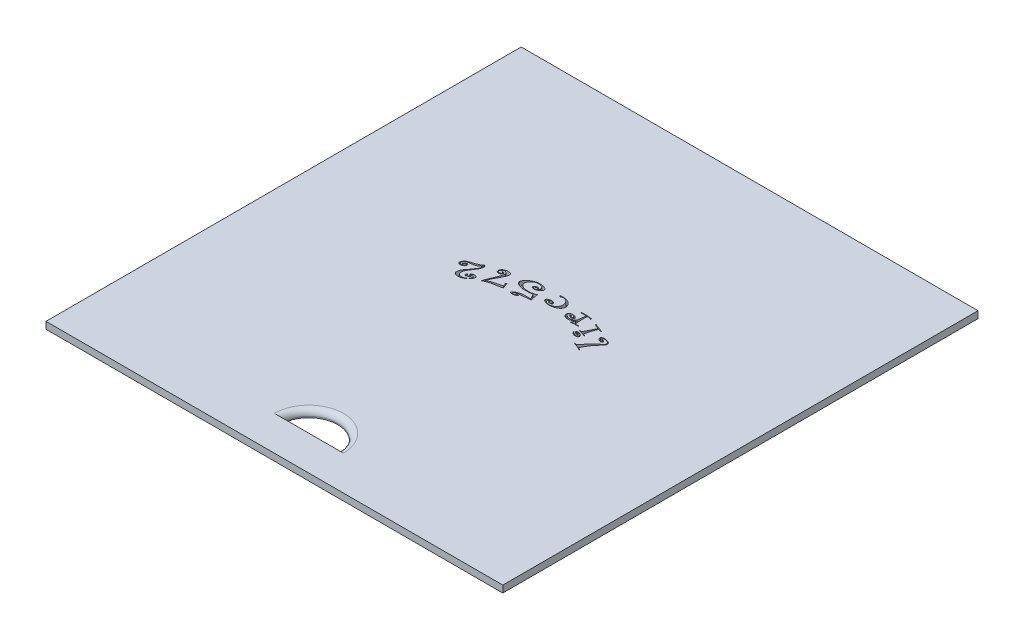
from build123d import *

# Parameters (mm, degrees)
SKETCH1_W           = 79.4
SKETCH1_H           = 82.6
BOSS_EXTRUDE1_DEPTH = 1.2
CUT_EXTRUDE1_DEPTH  = 1.2
FILLET1_R           = 1
CUT_EXTRUDE2_DEPTH  = 0.8


with BuildPart() as part:
    # Sketch1 → Boss-Extrude1 (new body)
    with BuildSketch(Plane(origin=(0, 0, 0), x_dir=(1, 0, 0), z_dir=(0, 1, 0))):
        with Locations((39.7, 41.3)):
            Rectangle(SKETCH1_W, SKETCH1_H)
    extrude(amount=BOSS_EXTRUDE1_DEPTH)

    # Sketch2 → Cut-Extrude1 (cut)
    with BuildSketch(Plane(origin=(0, 1.2, 0), x_dir=(1, 0, 0), z_dir=(0, 1, 0))):
        with BuildLine():
            Line((34.7, 6), (44.7, 6))
            ThreePointArc((44.7, 6), (39.7, 11), (34.7, 6))
        make_face()
    extrude(amount=-CUT_EXTRUDE1_DEPTH, mode=Mode.SUBTRACT)

    # Fillet1
    fillet1_edges = [part.edges().sort_by_distance(p)[0] for p in [
        (39.7, 1.2, -11),
    ]]
    fillet(fillet1_edges, radius=FILLET1_R)

    # Sketch3 → Cut-Extrude2 (cut)
    with BuildSketch(Plane(origin=(0, 1.2, 0), x_dir=(1, 0, 0), z_dir=(0, 1, 0))):
        with BuildLine():
            add(Edge.make_bspline(
                [(51.101468817, 45.483691384), (51.112393938, 45.493325818), (51.133333541, 45.511791629), (51.167338362, 45.534444238), (51.202154862, 45.550519658), (51.237630603, 45.559970103), (51.273756974, 45.562346287), (51.310180313, 45.557423283), (51.347339753, 45.546674113), (51.371005132, 45.535204417), (51.383261352, 45.5292643)],
                knots=[0, 0, 0, 0, 1.131463939, 2.168617172, 3.163840046, 4.099480961, 5.006746578, 5.958803498, 6.942871226, 8, 8, 8, 8], degree=3))
            add(Edge.make_bspline(
                [(51.383261352, 45.5292643), (51.401779129, 45.518820777), (51.43637211, 45.499311275), (51.480911654, 45.465240152), (51.516937026, 45.431546973), (51.541829774, 45.395519607), (51.556596144, 45.358290699), (51.560297462, 45.319759371), (51.554239427, 45.280162754), (51.542667468, 45.255601281), (51.536690171, 45.242914474)],
                knots=[0, 0, 0, 0, 1.385490915, 2.588229679, 3.651358738, 4.590727742, 5.422206136, 6.235933222, 7.088801537, 8, 8, 8, 8], degree=3))
            add(Edge.make_bspline(
                [(51.536690171, 45.242914474), (51.524558359, 45.225212772), (51.499611986, 45.188813158), (51.439398235, 45.151125356), (51.364019295, 45.129464671), (51.276089405, 45.120398881), (51.180742401, 45.125477258), (51.083389509, 45.142940683), (50.986825785, 45.174294799), (50.92541781, 45.204651951), (50.894112046, 45.220128015)],
                knots=[0, 0, 0, 0, 0.730976792, 1.503091207, 2.378086361, 3.410854815, 4.525631339, 5.648457872, 6.801184678, 8, 8, 8, 8], degree=3))
            add(Edge.make_bspline(
                [(50.894112046, 45.220128015), (50.868732019, 45.235273636), (50.818820108, 45.265058744), (50.754651896, 45.3230106), (50.701162278, 45.38919822), (50.660864227, 45.462623759), (50.634483603, 45.537934153), (50.622321222, 45.61064437), (50.628541631, 45.679413833), (50.64615209, 45.719734805), (50.654854234, 45.739659265)],
                knots=[0, 0, 0, 0, 1.1282261, 2.21874945, 3.286503988, 4.370082496, 5.405237361, 6.325581354, 7.172592129, 8, 8, 8, 8], degree=3))
            add(Edge.make_bspline(
                [(50.654854234, 45.739659265), (50.666103531, 45.757612934), (50.688595667, 45.793509966), (50.734741046, 45.839351463), (50.791297056, 45.875520017), (50.856959568, 45.90498961), (50.932722117, 45.924556477), (51.017702611, 45.937575464), (51.112351841, 45.941428998), (51.214301342, 45.937969302), (51.319765681, 45.929015279), (51.42418611, 45.914609099), (51.525787095, 45.895415383), (51.624355917, 45.872349699), (51.719573563, 45.843175583), (51.811743685, 45.809482275), (51.901524323, 45.772267552), (51.958695691, 45.742364469), (51.987102498, 45.727506488)],
                knots=[0, 0, 0, 0, 0.707731309, 1.415056343, 2.155683531, 2.944973386, 3.814867125, 4.766807096, 5.819208744, 6.981078961, 8.180684001, 9.361572365, 10.508784215, 11.641718982, 12.74925041, 13.840703282, 14.927107612, 16, 16, 16, 16], degree=3))
            add(Edge.make_bspline(
                [(51.987102498, 45.727506488), (52.009909488, 45.713804839), (52.056128512, 45.686038051), (52.117090336, 45.629632872), (52.172833979, 45.562915949), (52.221017356, 45.488108469), (52.259332211, 45.410768601), (52.276914264, 45.334125726), (52.275622558, 45.26128151), (52.257401945, 45.219013422), (52.24838722, 45.198101106)],
                knots=[0, 0, 0, 0, 0.99251405, 2.011358358, 3.086435766, 4.236499021, 5.333360717, 6.293381638, 7.155643334, 8, 8, 8, 8], degree=3))
            add(Edge.make_bspline(
                [(52.24838722, 45.198101106), (52.234684264, 45.173915911), (52.206160609, 45.123572749), (52.156979073, 45.047450915), (52.101038373, 44.967360557), (52.037682916, 44.883512359), (51.966866592, 44.796455687), (51.889362409, 44.705073127), (51.804246096, 44.610344847), (51.681365547, 44.47941867), (51.525626314, 44.312163744), (51.348457719, 44.1025896), (51.178260323, 43.889274837), (51.043413957, 43.704141154), (50.935549888, 43.546896106), (50.85030144, 43.414412736), (50.757909745, 43.268920673), (50.661955026, 43.108011745), (50.559280188, 42.933931071), (50.452403209, 42.744878396), (50.339189532, 42.542489307), (50.262789818, 42.402278568), (50.223430623, 42.33004555)],
                knots=[0, 0, 0, 0, 0.47326543, 0.985134873, 1.542481623, 2.13658539, 2.774225111, 3.453228778, 4.176826139, 4.942509109, 6.510909075, 8.067657421, 9.614277554, 11.156998882, 11.966576646, 12.861060725, 13.839504681, 14.901265418, 16.051065668, 17.2810043, 18.599242338, 20, 20, 20, 20], degree=3))
            Line((50.223430623, 42.33004555), (50.667007011, 42.102180967))
            Line((50.667007011, 42.102180967), (50.617636352, 42.030023849))
            add(Edge.make_bspline(
                [(50.617636352, 42.030023849), (50.505792446, 42.088658244), (50.282631215, 42.205650973), (49.938379672, 42.360015424), (49.590172917, 42.50153639), (49.352938139, 42.580680372), (49.234498331, 42.62019312)],
                knots=[0, 0, 0, 0, 1.006123031, 2.007509067, 3.005246002, 4, 4, 4, 4], degree=3))
            Line((49.234498331, 42.62019312), (49.277792602, 42.699186175))
            Line((49.277792602, 42.699186175), (49.609715345, 42.59816621))
            add(Edge.make_bspline(
                [(49.609715345, 42.59816621), (49.643065193, 42.638986664), (49.708492249, 42.719069849), (49.805711044, 42.835625209), (49.898731499, 42.947237483), (49.986143887, 43.054826103), (50.071902875, 43.155355331), (50.152030115, 43.25209862), (50.228781223, 43.343216157), (50.301941153, 43.429091973), (50.370551066, 43.510075969), (50.435608105, 43.585570726), (50.496118082, 43.656174637), (50.553050667, 43.721529678), (50.606478664, 43.7815583), (50.655313465, 43.836753532), (50.700622954, 43.886413292), (50.782506614, 43.976327304), (50.911161263, 44.108171149), (51.097131896, 44.281103649), (51.299514319, 44.460702386), (51.481308874, 44.606457006), (51.626395698, 44.722612403), (51.725382056, 44.805415092), (51.812733943, 44.882448528), (51.888019389, 44.954334031), (51.953047639, 45.018863211), (52.005358617, 45.078724928), (52.04860455, 45.13101461), (52.069511206, 45.166700236), (52.079007879, 45.182910134)],
                knots=[0, 0, 0, 0, 1.234883098, 2.422642643, 3.555724084, 4.638701999, 5.67003037, 6.651222529, 7.581543312, 8.461010372, 9.294154016, 10.068103575, 10.79573285, 11.472561155, 12.09862472, 12.678385671, 13.19906561, 13.673465433, 15.52743937, 17.512257676, 19.621981642, 21.864720983, 22.969839033, 23.976096886, 24.887853692, 25.697591365, 26.414798962, 27.032489745, 27.56051656, 28, 28, 28, 28], degree=3))
            add(Edge.make_bspline(
                [(52.079007879, 45.182910134), (52.086006429, 45.19988215), (52.100798838, 45.23575487), (52.10471323, 45.298733933), (52.094403828, 45.369432027), (52.071806974, 45.445352285), (52.040352876, 45.520735768), (51.998302301, 45.586696883), (51.948607034, 45.641823583), (51.90780049, 45.666620923), (51.887601629, 45.678895377)],
                knots=[0, 0, 0, 0, 0.764785453, 1.616480526, 2.600466881, 3.748429187, 4.926565457, 6.009226836, 7.014585798, 8, 8, 8, 8], degree=3))
            add(Edge.make_bspline(
                [(51.887601629, 45.678895377), (51.838750418, 45.703604305), (51.744204621, 45.75142554), (51.598009265, 45.802039524), (51.454483907, 45.831624833), (51.337207783, 45.838976873), (51.247725566, 45.834315013), (51.186273454, 45.824725755), (51.130047234, 45.808819531), (51.079281598, 45.786461628), (51.033270195, 45.758659319), (50.99339192, 45.723456175), (50.957661371, 45.683412713), (50.939672036, 45.652168553), (50.930570379, 45.636360654)],
                knots=[0, 0, 0, 0, 1.862682694, 3.605004146, 5.250245432, 6.83950152, 7.590841788, 8.298150326, 8.953071868, 9.574624238, 10.182389491, 10.775295738, 11.380364157, 12, 12, 12, 12], degree=3))
            add(Edge.make_bspline(
                [(50.930570379, 45.636360654), (50.925121745, 45.624153722), (50.914027797, 45.599299221), (50.909179673, 45.557330968), (50.914341063, 45.512655777), (50.928762206, 45.466590392), (50.952019265, 45.420834474), (50.98557251, 45.379612055), (51.027267987, 45.342020637), (51.060537601, 45.322824163), (51.07792281, 45.312792946)],
                knots=[0, 0, 0, 0, 0.813136283, 1.655624532, 2.542411271, 3.545719798, 4.590636183, 5.658664962, 6.776523259, 8, 8, 8, 8], degree=3))
            add(Edge.make_bspline(
                [(51.07792281, 45.312792946), (51.100016434, 45.301253571), (51.141458601, 45.279608562), (51.202446355, 45.255121019), (51.257099414, 45.238927536), (51.305624999, 45.23345035), (51.34843889, 45.23540276), (51.384845397, 45.248701499), (51.416101472, 45.27062547), (51.429013964, 45.291934337), (51.435670206, 45.302918814)],
                knots=[0, 0, 0, 0, 1.501482147, 2.816408641, 3.956803364, 4.924161882, 5.75051273, 6.513256574, 7.233600813, 8, 8, 8, 8], degree=3))
            add(Edge.make_bspline(
                [(51.435670206, 45.302918814), (51.438841177, 45.31151364), (51.445401711, 45.329295779), (51.431749435, 45.359373077), (51.403751838, 45.385764481), (51.378636604, 45.400225493), (51.364272636, 45.408496071)],
                knots=[0, 0, 0, 0, 0.75013289, 1.551976511, 2.599920305, 4, 4, 4, 4], degree=3))
            add(Edge.make_bspline(
                [(51.364272636, 45.408496071), (51.346041529, 45.417481709), (51.310585686, 45.43495697), (51.254248481, 45.450134468), (51.197684012, 45.455987024), (51.160448101, 45.452183672), (51.141724893, 45.450271245)],
                knots=[0, 0, 0, 0, 1.056522197, 2.05472361, 3.021863215, 4, 4, 4, 4], degree=3))
            Line((51.141724893, 45.450271245), (51.101468817, 45.483691384))
        make_face()
        with BuildLine():
            Line((47.425936846, 44.354470273), (47.472269311, 44.341557947))
            add(Edge.make_bspline(
                [(47.472269311, 44.341557947), (47.479949886, 44.324874108), (47.495363534, 44.291392394), (47.526375685, 44.244897969), (47.563272377, 44.201030125), (47.606656345, 44.160425224), (47.655574556, 44.122068873), (47.710967917, 44.087117922), (47.772130408, 44.054529028), (47.815937904, 44.035890217), (47.838371742, 44.026345273)],
                knots=[0, 0, 0, 0, 0.887530455, 1.781127261, 2.693997008, 3.655856242, 4.650769691, 5.697431574, 6.820853707, 8, 8, 8, 8], degree=3))
            add(Edge.make_bspline(
                [(47.838371742, 44.026345273), (47.87382646, 44.013177025), (47.943213882, 43.987405822), (48.050011057, 43.96223874), (48.15573193, 43.949357597), (48.242526464, 43.947973626), (48.308813114, 43.952411373), (48.353394513, 43.960306232), (48.393264554, 43.969708008), (48.427746532, 43.982625058), (48.457439478, 43.998382795), (48.480989405, 44.018435362), (48.500178729, 44.040888888), (48.508628839, 44.058034568), (48.512850908, 44.06660135)],
                knots=[0, 0, 0, 0, 1.875599323, 3.67068212, 5.430232796, 7.151823157, 7.970961862, 8.72287062, 9.396360067, 10.000788185, 10.546318212, 11.054696884, 11.527682471, 12, 12, 12, 12], degree=3))
            add(Edge.make_bspline(
                [(48.512850908, 44.06660135), (48.519419957, 44.087911382), (48.532561501, 44.130542624), (48.524959337, 44.200141135), (48.494458523, 44.268396122), (48.444566122, 44.332975448), (48.386141841, 44.39514544), (48.320801592, 44.448029367), (48.254243765, 44.493669063), (48.20611531, 44.514918776), (48.182447263, 44.525368711)],
                knots=[0, 0, 0, 0, 0.859327191, 1.719105059, 2.649481716, 3.734045925, 4.875600344, 5.959226561, 6.99641237, 8, 8, 8, 8], degree=3))
            add(Edge.make_bspline(
                [(48.182447263, 44.525368711), (48.160050531, 44.533850283), (48.118067417, 44.549749156), (48.057116035, 44.566447453), (48.002661597, 44.573300809), (47.954805729, 44.57365415), (47.913039285, 44.563997687), (47.87869942, 44.544545643), (47.851039628, 44.516415236), (47.839736885, 44.492884846), (47.83381445, 44.480555343)],
                knots=[0, 0, 0, 0, 1.459116044, 2.735141845, 3.839269907, 4.795908357, 5.63781126, 6.4185477, 7.171347263, 8, 8, 8, 8], degree=3))
            add(Edge.make_bspline(
                [(47.83381445, 44.480555343), (47.828648592, 44.466281152), (47.818787208, 44.439032386), (47.814162929, 44.39728041), (47.818223432, 44.357924812), (47.833617623, 44.322217531), (47.857254351, 44.28911924), (47.890649836, 44.259957167), (47.932441678, 44.232721985), (47.96469441, 44.219004256), (47.981926429, 44.211675134)],
                knots=[0, 0, 0, 0, 1.034888617, 1.975554252, 2.847424236, 3.709092515, 4.602694679, 5.607754826, 6.721869045, 8, 8, 8, 8], degree=3))
            add(Edge.make_bspline(
                [(47.981926429, 44.211675134), (47.996978195, 44.206726666), (48.028968331, 44.196209484), (48.071568859, 44.193964398), (48.104794333, 44.196327648), (48.125388698, 44.201274095), (48.141201167, 44.210144356), (48.146548498, 44.219494076), (48.149027124, 44.223827912)],
                knots=[0, 0, 0, 0, 1.588925903, 3.377009382, 4.24666566, 4.932712355, 5.505284693, 6, 6, 6, 6], degree=3))
            add(Edge.make_bspline(
                [(48.149027124, 44.223827912), (48.151151113, 44.233033456), (48.155556748, 44.252127843), (48.139029468, 44.281931114), (48.106183649, 44.304861248), (48.078927148, 44.317052864), (48.063198131, 44.324088329)],
                knots=[0, 0, 0, 0, 0.750980581, 1.557704116, 2.590614582, 4, 4, 4, 4], degree=3))
            add(Edge.make_bspline(
                [(48.063198131, 44.324088329), (48.044344826, 44.329960431), (48.001627694, 44.343265228), (47.956825092, 44.344119118), (47.931796221, 44.344596141)],
                knots=[0, 0, 0, 0, 0.882704593, 2, 2, 2, 2], degree=3))
            add(Edge.make_bspline(
                [(47.931796221, 44.344596141), (47.946819411, 44.360056637), (47.975346959, 44.389414583), (48.032720929, 44.41245884), (48.095264193, 44.415926348), (48.135368936, 44.402069724), (48.15662261, 44.39472635)],
                knots=[0, 0, 0, 0, 1.033550389, 1.962609586, 2.920276604, 4, 4, 4, 4], degree=3))
            add(Edge.make_bspline(
                [(48.15662261, 44.39472635), (48.166228638, 44.390316537), (48.18535704, 44.381535314), (48.209762572, 44.36124386), (48.230204227, 44.33622379), (48.244817944, 44.307248557), (48.256955565, 44.278875811), (48.264011182, 44.25289613), (48.266655472, 44.23039382), (48.263052412, 44.217461403), (48.261440318, 44.211675134)],
                knots=[0, 0, 0, 0, 1.115544312, 2.221373974, 3.327203637, 4.51519498, 5.645791094, 6.589088465, 7.368724904, 8, 8, 8, 8], degree=3))
            add(Edge.make_bspline(
                [(48.261440318, 44.211675134), (48.256475508, 44.202319609), (48.246296503, 44.183138624), (48.218137255, 44.162664728), (48.182811951, 44.147133033), (48.139533682, 44.139045624), (48.09122506, 44.136844854), (48.039947029, 44.141754457), (47.986237902, 44.152988562), (47.950891242, 44.166124245), (47.932555769, 44.172938155)],
                knots=[0, 0, 0, 0, 0.698726332, 1.43255007, 2.264873175, 3.265946459, 4.348857197, 5.485817681, 6.695811116, 8, 8, 8, 8], degree=3))
            add(Edge.make_bspline(
                [(47.932555769, 44.172938155), (47.908342356, 44.183731829), (47.860519506, 44.20504994), (47.792448493, 44.242645332), (47.731099718, 44.287450677), (47.675445472, 44.334187082), (47.631184585, 44.384125748), (47.603573351, 44.435650791), (47.592575856, 44.488170207), (47.602539915, 44.52017177), (47.607468964, 44.536002391)],
                knots=[0, 0, 0, 0, 1.199393131, 2.368868735, 3.510173751, 4.630998761, 5.654893937, 6.505426749, 7.260660395, 8, 8, 8, 8], degree=3))
            add(Edge.make_bspline(
                [(47.607468964, 44.536002391), (47.615941236, 44.551713466), (47.633664934, 44.584580484), (47.6870704, 44.616148064), (47.754802421, 44.636063272), (47.837785268, 44.642403458), (47.928878635, 44.640252743), (48.023244742, 44.627648459), (48.11774895, 44.606284296), (48.178876734, 44.58331665), (48.209791013, 44.571701176)],
                knots=[0, 0, 0, 0, 0.650000474, 1.35977828, 2.213700195, 3.259326602, 4.422060126, 5.584793651, 6.778552771, 8, 8, 8, 8], degree=3))
            add(Edge.make_bspline(
                [(48.209791013, 44.571701176), (48.245186338, 44.556136122), (48.314056958, 44.525850345), (48.407447663, 44.466588752), (48.489286265, 44.398402534), (48.556978203, 44.322380505), (48.610035588, 44.243439353), (48.639472661, 44.162499179), (48.647116912, 44.081915309), (48.631526738, 44.032687729), (48.623745006, 44.008116107)],
                knots=[0, 0, 0, 0, 1.207807889, 2.350097808, 3.446002413, 4.528322087, 5.525472317, 6.399493118, 7.201117531, 8, 8, 8, 8], degree=3))
            add(Edge.make_bspline(
                [(48.623745006, 44.008116107), (48.618049678, 43.995499327), (48.606795532, 43.970568177), (48.583232267, 43.936895263), (48.555953813, 43.905898202), (48.522295667, 43.87937991), (48.484636574, 43.854955728), (48.441342883, 43.834543356), (48.39360136, 43.81702982), (48.324040801, 43.799526569), (48.234750168, 43.784974145), (48.127458521, 43.785309716), (48.022367234, 43.800619116), (47.956058719, 43.823953145), (47.922681638, 43.835698572)],
                knots=[0, 0, 0, 0, 0.630317221, 1.245526489, 1.86720955, 2.507713315, 3.193497879, 3.911696397, 4.686478323, 5.510265892, 7.181685499, 8.799012329, 10.38874956, 12, 12, 12, 12], degree=3))
            add(Edge.make_bspline(
                [(47.922681638, 43.835698572), (47.883318521, 43.852131249), (47.808367229, 43.8834207), (47.707104593, 43.940289421), (47.620220756, 43.998949834), (47.549118279, 44.062161079), (47.494278557, 44.129722294), (47.454043283, 44.20074123), (47.430355041, 44.276526591), (47.427409578, 44.328489046), (47.425936846, 44.354470273)],
                knots=[0, 0, 0, 0, 1.340061465, 2.551610365, 3.644597448, 4.630925581, 5.53099325, 6.368330679, 7.18416534, 8, 8, 8, 8], degree=3))
        make_face()
        with BuildLine():
            add(Edge.make_bspline(
                [(48.306253686, 47.323545794), (48.341433142, 47.309335247), (48.410222634, 47.281548112), (48.51105244, 47.241448322), (48.606768244, 47.203503578), (48.697294981, 47.167516243), (48.783159745, 47.134579977), (48.863281586, 47.10218675), (48.939039171, 47.073611759), (49.009285642, 47.046162943), (49.074636538, 47.021175076), (49.13480981, 46.998160934), (49.190086981, 46.977876485), (49.240350907, 46.95930657), (49.28593964, 46.94386476), (49.32583226, 46.928886728), (49.36128796, 46.91775573), (49.41847894, 46.898898664), (49.497767343, 46.875166109), (49.597893025, 46.846457042), (49.690963819, 46.820236812), (49.750889495, 46.804678726), (49.779777992, 46.797178607)],
                knots=[0, 0, 0, 0, 1.453593902, 2.84234037, 4.157240336, 5.398296862, 6.574547136, 7.68050581, 8.709106835, 9.676425609, 10.569922707, 11.389607239, 12.144580999, 12.825787458, 13.442398998, 13.988530029, 14.457848806, 14.86582154, 16.295693291, 17.628079586, 18.856563304, 20, 20, 20, 20], degree=3))
            Line((49.779777992, 46.797178607), (49.727369138, 46.666536245))
            Line((49.727369138, 46.666536245), (49.239738929, 46.851106558))
            add(Edge.make_bspline(
                [(49.239738929, 46.851106558), (49.206001052, 46.765399983), (49.138961486, 46.595094916), (49.044516852, 46.338735559), (48.957316914, 46.0831435), (48.876898338, 45.827942444), (48.801362488, 45.573932611), (48.733089548, 45.320138041), (48.671357968, 45.06711424), (48.635009378, 44.898140247), (48.616909068, 44.813997183)],
                knots=[0, 0, 0, 0, 1.036368641, 2.059338288, 3.073739702, 4.074719677, 5.069865403, 6.055299839, 7.031608192, 8, 8, 8, 8], degree=3))
            Line((48.616909068, 44.813997183), (49.029343964, 44.636262808))
            Line((49.029343964, 44.636262808), (48.994404728, 44.548914718))
            add(Edge.make_bspline(
                [(48.994404728, 44.548914718), (48.963544942, 44.561895862), (48.90442809, 44.58676332), (48.818810242, 44.621496621), (48.741286049, 44.654139382), (48.670709306, 44.683408956), (48.607442196, 44.708683308), (48.551652443, 44.731870807), (48.50321285, 44.751419016), (48.473351063, 44.763605656), (48.459682506, 44.769183815)],
                knots=[0, 0, 0, 0, 1.389349973, 2.661521947, 3.834265359, 4.880121228, 5.832266706, 6.661521525, 7.387341734, 8, 8, 8, 8], degree=3))
            add(Edge.make_bspline(
                [(48.459682506, 44.769183815), (48.436462576, 44.778245865), (48.388103344, 44.797119039), (48.310873097, 44.822590414), (48.227116575, 44.848404208), (48.136319224, 44.873253368), (48.039187012, 44.898485408), (47.934845224, 44.922798975), (47.823551434, 44.945977655), (47.746985451, 44.961160644), (47.707729381, 44.9689451)],
                knots=[0, 0, 0, 0, 0.767686788, 1.598831033, 2.504232518, 3.467350543, 4.498278524, 5.595515415, 6.767199061, 8, 8, 8, 8], degree=3))
            Line((47.707729381, 44.9689451), (47.7517832, 45.0783201))
            Line((47.7517832, 45.0783201), (48.110290144, 44.995529301))
            Line((48.110290144, 44.995529301), (48.496900388, 45.727734162))
            Line((48.496900388, 45.727734162), (49.071119138, 46.896679475))
            add(Edge.make_bspline(
                [(49.071119138, 46.896679475), (49.000852222, 46.924584423), (48.862088191, 46.979691483), (48.65497544, 47.055806275), (48.452985894, 47.127225477), (48.31903045, 47.169710003), (48.253085283, 47.190624787)],
                knots=[0, 0, 0, 0, 1.043425523, 2.060570484, 3.045234742, 4, 4, 4, 4], degree=3))
            Line((48.253085283, 47.190624787), (48.306253686, 47.323545794))
        make_face()
        with BuildLine():
            add(Edge.make_bspline(
                [(45.920035355, 46.149225258), (45.899401239, 46.124575999), (45.858762066, 46.07602895), (45.791855323, 46.00988618), (45.722937095, 45.949207973), (45.651492174, 45.893662218), (45.575772912, 45.846438601), (45.498640963, 45.803326236), (45.417870054, 45.767560143), (45.335317525, 45.737603194), (45.25182977, 45.713287526), (45.168872573, 45.694876852), (45.086844433, 45.682896161), (45.006187415, 45.675980042), (44.926740186, 45.674190624), (44.848277012, 45.678841645), (44.770819017, 45.689311691), (44.720131463, 45.700723882), (44.694883445, 45.706408417)],
                knots=[0, 0, 0, 0, 1.122207567, 2.210203016, 3.281649903, 4.32869849, 5.366369774, 6.395338465, 7.412613516, 8.44764393, 9.460682403, 10.447642423, 11.413095021, 12.353810925, 13.273638571, 14.185997362, 15.096425687, 16, 16, 16, 16], degree=3))
            add(Edge.make_bspline(
                [(44.694883445, 45.706408417), (44.648472764, 45.719817355), (44.558342438, 45.745857739), (44.435462318, 45.809622725), (44.325648743, 45.885915093), (44.249133361, 45.964635511), (44.197103495, 46.032264624), (44.165254929, 46.084024693), (44.139374376, 46.135870911), (44.122214597, 46.188984822), (44.110263326, 46.242082641), (44.106459408, 46.295825575), (44.110476415, 46.349673387), (44.117740914, 46.38500185), (44.121424244, 46.402914494)],
                knots=[0, 0, 0, 0, 1.739795689, 3.37871263, 4.971210335, 6.548028411, 7.317540222, 8.047963535, 8.738718928, 9.403410249, 10.057653283, 10.699003565, 11.340353847, 12, 12, 12, 12], degree=3))
            add(Edge.make_bspline(
                [(44.121424244, 46.402914494), (44.127496963, 46.423602781), (44.139383029, 46.464095732), (44.165706504, 46.521078099), (44.198426119, 46.572887358), (44.237723063, 46.619938835), (44.283812925, 46.661895672), (44.336468056, 46.699396514), (44.396259052, 46.730947283), (44.461532584, 46.758337341), (44.531530031, 46.779943163), (44.605189641, 46.796129187), (44.681955844, 46.805816712), (44.761695999, 46.809548761), (44.844448938, 46.807113028), (44.929948905, 46.798667778), (45.018746483, 46.784174082), (45.078278807, 46.770142902), (45.108837438, 46.762940535)],
                knots=[0, 0, 0, 0, 0.883819931, 1.729890841, 2.565758088, 3.391818388, 4.237442671, 5.11667098, 6.03704426, 7.005644034, 8.017730485, 9.038683181, 10.096654472, 11.188762611, 12.311235208, 13.490770564, 14.711983465, 16, 16, 16, 16], degree=3))
            add(Edge.make_bspline(
                [(45.108837438, 46.762940535), (45.139511583, 46.753890308), (45.198781923, 46.73640294), (45.28065148, 46.697343821), (45.351501596, 46.647461105), (45.410252915, 46.588603894), (45.455901721, 46.52516581), (45.485726796, 46.45923067), (45.496868116, 46.391214959), (45.489346963, 46.34741518), (45.485573549, 46.325440535)],
                knots=[0, 0, 0, 0, 1.20448087, 2.327366971, 3.402663971, 4.455654188, 5.448835841, 6.333772956, 7.164042681, 8, 8, 8, 8], degree=3))
            add(Edge.make_bspline(
                [(45.485573549, 46.325440535), (45.479688193, 46.314446293), (45.465460287, 46.287867605), (45.41790192, 46.259432168), (45.351941334, 46.232292564), (45.269035112, 46.206891389), (45.180580163, 46.187734196), (45.097900343, 46.175352474), (45.025644608, 46.173397509), (44.982190646, 46.180777127), (44.962244556, 46.184164494)],
                knots=[0, 0, 0, 0, 0.523318698, 1.265128057, 2.274293619, 3.583511455, 4.940920279, 6.126926033, 7.140228007, 8, 8, 8, 8], degree=3))
            add(Edge.make_bspline(
                [(44.962244556, 46.184164494), (44.937274315, 46.191016041), (44.888620893, 46.20436598), (44.820621177, 46.23185511), (44.759063709, 46.26328378), (44.705050364, 46.297431135), (44.662287068, 46.335710631), (44.631994438, 46.375523456), (44.617944152, 46.419221932), (44.622159816, 46.44743964), (44.624245424, 46.461399737)],
                knots=[0, 0, 0, 0, 1.305997867, 2.544679646, 3.693417147, 4.792166414, 5.760066816, 6.575607161, 7.295312682, 8, 8, 8, 8], degree=3))
            add(Edge.make_bspline(
                [(44.624245424, 46.461399737), (44.627080805, 46.46874937), (44.632969322, 46.48401308), (44.651832007, 46.503042304), (44.6787876, 46.515809132), (44.712090954, 46.526966139), (44.753475683, 46.532121963), (44.802195123, 46.533998632), (44.858564828, 46.533584203), (44.898464098, 46.5296013), (44.919709834, 46.527480466)],
                knots=[0, 0, 0, 0, 0.581420745, 1.207494087, 1.932055048, 2.783763053, 3.811902933, 5.018606658, 6.412454746, 8, 8, 8, 8], degree=3))
            add(Edge.make_bspline(
                [(44.919709834, 46.527480466), (44.909588362, 46.517572811), (44.890695355, 46.49907892), (44.868004792, 46.470151529), (44.85098182, 46.443664331), (44.844973854, 46.425585079), (44.842235876, 46.417345917)],
                knots=[0, 0, 0, 0, 1.24649594, 2.32674224, 3.237455127, 4, 4, 4, 4], degree=3))
            add(Edge.make_bspline(
                [(44.842235876, 46.417345917), (44.839312431, 46.402668843), (44.833899763, 46.375494689), (44.847188925, 46.335386627), (44.879359622, 46.306540429), (44.907250054, 46.297695074), (44.922748029, 46.292779945)],
                knots=[0, 0, 0, 0, 1.047864496, 1.940088965, 2.855361969, 4, 4, 4, 4], degree=3))
            add(Edge.make_bspline(
                [(44.922748029, 46.292779945), (44.937618453, 46.289795262), (44.96672586, 46.283953034), (45.011332567, 46.287346358), (45.054078351, 46.300937493), (45.094174842, 46.322809081), (45.129531513, 46.350077661), (45.158483795, 46.380105418), (45.180057055, 46.4124336), (45.187819368, 46.436110101), (45.191628237, 46.447727862)],
                knots=[0, 0, 0, 0, 1.065562819, 2.085735509, 3.113534892, 4.207875961, 5.28991409, 6.249714701, 7.141157005, 8, 8, 8, 8], degree=3))
            add(Edge.make_bspline(
                [(45.191628237, 46.447727862), (45.193382952, 46.458878915), (45.197093459, 46.482458845), (45.187084844, 46.520025872), (45.166069244, 46.558715803), (45.135536644, 46.597932076), (45.099093106, 46.635494156), (45.057923185, 46.667567566), (45.01343127, 46.692317867), (44.981197777, 46.701968846), (44.965282751, 46.706733938)],
                knots=[0, 0, 0, 0, 0.723410049, 1.529717183, 2.452468933, 3.562619494, 4.732044275, 5.829198807, 6.928184474, 8, 8, 8, 8], degree=3))
            add(Edge.make_bspline(
                [(44.965282751, 46.706733938), (44.922686793, 46.716044427), (44.841654497, 46.733756209), (44.722210509, 46.740352199), (44.612402627, 46.728136017), (44.514278868, 46.696178619), (44.42976845, 46.649388432), (44.36150641, 46.588675121), (44.309712858, 46.51466514), (44.291652258, 46.457745486), (44.282448549, 46.428739147)],
                knots=[0, 0, 0, 0, 1.269712117, 2.41543309, 3.471151236, 4.472619954, 5.404731999, 6.267280496, 7.117003579, 8, 8, 8, 8], degree=3))
            add(Edge.make_bspline(
                [(44.282448549, 46.428739147), (44.280235414, 46.417896056), (44.275837307, 46.396347862), (44.27709034, 46.362834195), (44.283654026, 46.328949363), (44.298498422, 46.295637055), (44.316211223, 46.260717428), (44.342236163, 46.226719173), (44.373243931, 46.191711643), (44.423333735, 46.1452672), (44.494499428, 46.091530711), (44.589457592, 46.036703764), (44.693378394, 45.991269629), (44.767257621, 45.97013845), (44.805017994, 45.959338105)],
                knots=[0, 0, 0, 0, 0.521811519, 1.036982536, 1.574903546, 2.144306581, 2.755158207, 3.423540387, 4.161590509, 4.966580728, 6.650642078, 8.368064439, 10.143683352, 12, 12, 12, 12], degree=3))
            add(Edge.make_bspline(
                [(44.805017994, 45.959338105), (44.844880357, 45.950244599), (44.92327944, 45.932359997), (45.041127827, 45.918642846), (45.156089002, 45.917506423), (45.268847109, 45.925712073), (45.381161853, 45.949360683), (45.492035364, 45.991758472), (45.604336149, 46.047860073), (45.693055341, 46.109047163), (45.761827275, 46.159652969), (45.807541209, 46.195533532), (45.846892858, 46.227849978), (45.879651896, 46.256908086), (45.906355954, 46.281661858), (45.926514598, 46.302888045), (45.940386628, 46.321100369), (45.945286189, 46.333189023), (45.947379105, 46.338352862)],
                knots=[0, 0, 0, 0, 1.535039039, 3.019029536, 4.445689306, 5.848341951, 7.25848661, 8.738907434, 10.295565127, 11.962568586, 12.778565397, 13.503403881, 14.145114728, 14.690855525, 15.148335651, 15.51172064, 15.791424596, 16, 16, 16, 16], degree=3))
            add(Edge.make_bspline(
                [(45.947379105, 46.338352862), (45.948179329, 46.341890011), (45.950505055, 46.352170183), (45.953120364, 46.373310857), (45.957570217, 46.404752134), (45.964943542, 46.446623339), (45.972142078, 46.499385168), (45.981273784, 46.562677125), (45.991946609, 46.636601327), (46.004103494, 46.72091054), (46.017780314, 46.816106431), (46.033136236, 46.92187852), (46.048562564, 47.038487235), (46.067489924, 47.165162391), (46.085689924, 47.302570167), (46.107763792, 47.450243434), (46.129293949, 47.608841927), (46.144571017, 47.718204805), (46.15245723, 47.774659285)],
                knots=[0, 0, 0, 0, 0.119925254, 0.348544008, 0.703905177, 1.170709042, 1.754687097, 2.465409435, 3.286294589, 4.225633359, 5.283425768, 6.467962998, 7.761497177, 9.174650588, 10.705089192, 12.346859501, 14.114203338, 16, 16, 16, 16], degree=3))
            add(Edge.make_bspline(
                [(46.15245723, 47.774659285), (46.070443312, 47.778533377), (45.909250547, 47.78614764), (45.671500828, 47.783094256), (45.442509368, 47.771285501), (45.29358997, 47.75367917), (45.220491084, 47.74503689)],
                knots=[0, 0, 0, 0, 1.054917786, 2.073368985, 3.05428989, 4, 4, 4, 4], degree=3))
            Line((45.220491084, 47.74503689), (45.203781015, 47.879476994))
            add(Edge.make_bspline(
                [(45.203781015, 47.879476994), (45.281239727, 47.88360431), (45.432552345, 47.891666863), (45.65491341, 47.897963357), (45.867403233, 47.89776905), (46.04012489, 47.893709642), (46.177832199, 47.88649203), (46.28624565, 47.879017572), (46.400903128, 47.868045902), (46.521943736, 47.855240212), (46.649340247, 47.840048167), (46.782786311, 47.821820293), (46.922489495, 47.80037528), (47.017595613, 47.784864061), (47.066194209, 47.776937931)],
                knots=[0, 0, 0, 0, 1.493214579, 2.916937301, 4.281638786, 5.583426288, 6.242291297, 6.936103959, 7.675224421, 8.459443259, 9.279206483, 10.144957638, 11.052085642, 12, 12, 12, 12], degree=3))
            Line((47.066194209, 47.776937931), (47.033533619, 47.649333765))
            add(Edge.make_bspline(
                [(47.033533619, 47.649333765), (46.97642559, 47.663018937), (46.862952908, 47.69021114), (46.69203986, 47.721533517), (46.522377064, 47.746774326), (46.409251492, 47.756265901), (46.352978063, 47.76098741)],
                knots=[0, 0, 0, 0, 1.02040964, 2.027536569, 3.018813532, 4, 4, 4, 4], degree=3))
            add(Edge.make_bspline(
                [(46.352978063, 47.76098741), (46.347640859, 47.736734024), (46.336084163, 47.684217947), (46.32355944, 47.597704318), (46.314033418, 47.497832998), (46.307334046, 47.384582776), (46.303954112, 47.257936092), (46.302223981, 47.117902771), (46.304242332, 46.964205197), (46.30763014, 46.800364297), (46.314507572, 46.632997311), (46.323549402, 46.468404246), (46.334941205, 46.310145436), (46.348218317, 46.157883126), (46.365476144, 46.012140487), (46.383106745, 45.872208665), (46.40443508, 45.738516008), (46.420882851, 45.651684403), (46.428932924, 45.609186195)],
                knots=[0, 0, 0, 0, 0.551076079, 1.193249999, 1.938641237, 2.777504967, 3.71080082, 4.750508945, 5.885747122, 7.122403799, 8.387850938, 9.603581287, 10.781122914, 11.909608809, 12.995654276, 14.038440912, 15.039949273, 16, 16, 16, 16], degree=3))
            Line((46.428932924, 45.609186195), (47.018342647, 45.59551432))
            Line((47.018342647, 45.59551432), (47.035812265, 45.503608938))
            add(Edge.make_bspline(
                [(47.035812265, 45.503608938), (46.971278812, 45.50859465), (46.845359354, 45.518322908), (46.660400734, 45.525406621), (46.484060255, 45.524332858), (46.316042584, 45.517948156), (46.156578786, 45.504471748), (46.00575509, 45.483934696), (45.863292884, 45.457282622), (45.772295596, 45.432780425), (45.727869556, 45.42081814)],
                knots=[0, 0, 0, 0, 1.178932636, 2.300365959, 3.370311164, 4.390361536, 5.362388579, 6.283973768, 7.16221406, 8, 8, 8, 8], degree=3))
            add(Edge.make_bspline(
                [(45.727869556, 45.42081814), (45.739605505, 45.452433896), (45.761150683, 45.510474974), (45.789157853, 45.589673875), (45.810286435, 45.653145269), (45.820648545, 45.690423606), (45.825091779, 45.706408417)],
                knots=[0, 0, 0, 0, 1.340918052, 2.461694343, 3.340380276, 4, 4, 4, 4], degree=3))
            add(Edge.make_bspline(
                [(45.825091779, 45.706408417), (45.843011307, 45.779680686), (45.878888091, 45.926379494), (45.906309988, 46.074891277), (45.920035355, 46.149225258)],
                knots=[0, 0, 0, 0, 0.998948385, 2, 2, 2, 2], degree=3))
        make_face()
        with BuildLine():
            add(Edge.make_bspline(
                [(40.800915336, 48.564864729), (40.871275079, 48.570317582), (41.005310322, 48.580705263), (41.196533576, 48.589462082), (41.36791927, 48.590362463), (41.475159119, 48.58386623), (41.525524711, 48.58081525)],
                knots=[0, 0, 0, 0, 1.167151201, 2.223421892, 3.165623518, 4, 4, 4, 4], degree=3))
            add(Edge.make_bspline(
                [(41.525524711, 48.58081525), (41.580586, 48.575368681), (41.688791317, 48.564665196), (41.846490582, 48.533757015), (41.996741115, 48.492238134), (42.139149533, 48.438733866), (42.274726097, 48.374899787), (42.402198955, 48.298801483), (42.522367288, 48.211520096), (42.633532131, 48.114504246), (42.733940534, 48.010570089), (42.820986484, 47.9027433), (42.893338091, 47.792044157), (42.949992029, 47.678017197), (42.992078665, 47.561264587), (43.019768714, 47.44177241), (43.032638057, 47.319423462), (43.028484154, 47.237436539), (43.026392766, 47.196158132)],
                knots=[0, 0, 0, 0, 1.174892754, 2.308875142, 3.408995011, 4.482967072, 5.536761953, 6.588344522, 7.631932249, 8.68792111, 9.718790185, 10.698240868, 11.62769398, 12.522512201, 13.397006042, 14.258131759, 15.123012013, 16, 16, 16, 16], degree=3))
            add(Edge.make_bspline(
                [(43.026392766, 47.196158132), (43.021500983, 47.158194529), (43.011740237, 47.082444412), (42.975544464, 46.972098198), (42.921784021, 46.86693357), (42.85060095, 46.76602735), (42.761587859, 46.670593559), (42.655807257, 46.578771453), (42.532017113, 46.492822907), (42.393827592, 46.411929019), (42.245030888, 46.339094513), (42.089867411, 46.276820014), (41.930824505, 46.225617272), (41.767790467, 46.186791433), (41.600925907, 46.16042923), (41.430163769, 46.145101399), (41.255248925, 46.141906834), (41.137623444, 46.148968086), (41.078150579, 46.15253834)],
                knots=[0, 0, 0, 0, 0.760946729, 1.518343872, 2.298540998, 3.105660666, 3.969189477, 4.891262044, 5.890043552, 6.965783064, 8.07746924, 9.186029528, 10.292638831, 11.401852505, 12.520071194, 13.653980274, 14.813824053, 16, 16, 16, 16], degree=3))
            add(Edge.make_bspline(
                [(41.078150579, 46.15253834), (41.022766449, 46.158726597), (40.910999482, 46.171214701), (40.744707977, 46.211612885), (40.577901558, 46.266223161), (40.441802837, 46.324506621), (40.338965625, 46.377362387), (40.27178717, 46.417943256), (40.215654795, 46.460090746), (40.169871727, 46.502155413), (40.134013664, 46.545047818), (40.111393681, 46.589881473), (40.09652051, 46.635176789), (40.097223175, 46.665882934), (40.097573322, 46.681184173)],
                knots=[0, 0, 0, 0, 1.689593436, 3.409654283, 5.180773614, 7.011735551, 7.894850701, 8.688073558, 9.390278453, 10.020825734, 10.572755157, 11.074433341, 11.538779068, 12, 12, 12, 12], degree=3))
            add(Edge.make_bspline(
                [(40.097573322, 46.681184173), (40.099353238, 46.693966532), (40.102929203, 46.719647107), (40.117732313, 46.756887114), (40.138045628, 46.793638058), (40.166768654, 46.828598658), (40.202531349, 46.862009895), (40.244180724, 46.895801157), (40.294079182, 46.927175691), (40.368299671, 46.968416967), (40.467639197, 47.011575377), (40.591879684, 47.04710935), (40.718921969, 47.064804182), (40.803918826, 47.061229639), (40.846488252, 47.059439382)],
                knots=[0, 0, 0, 0, 0.512543485, 1.029732624, 1.585346292, 2.180923551, 2.823125226, 3.533718887, 4.314472266, 5.167969708, 6.916612639, 8.61559875, 10.304972417, 12, 12, 12, 12], degree=3))
            add(Edge.make_bspline(
                [(40.846488252, 47.059439382), (40.883795834, 47.055256784), (40.956649208, 47.047089105), (41.061984568, 47.024577293), (41.160117441, 46.991461283), (41.236074024, 46.956768604), (41.291614906, 46.925762172), (41.326650322, 46.900365732), (41.356568667, 46.874835727), (41.380558382, 46.848136056), (41.398521101, 46.820173517), (41.410945654, 46.791231357), (41.417294058, 46.760708194), (41.417038789, 46.740201089), (41.416909259, 46.729795285)],
                knots=[0, 0, 0, 0, 1.894972956, 3.700458937, 5.42676205, 7.114380953, 7.910422781, 8.634195159, 9.295668238, 9.893409267, 10.439568679, 10.966692264, 11.475674495, 12, 12, 12, 12], degree=3))
            add(Edge.make_bspline(
                [(41.416909259, 46.729795285), (41.413891112, 46.711265489), (41.407943503, 46.674750377), (41.380779246, 46.624873029), (41.338392448, 46.58456984), (41.283319479, 46.552887632), (41.217042817, 46.529983645), (41.14030548, 46.515769014), (41.05383806, 46.51076431), (40.993067856, 46.514435666), (40.961180092, 46.516362125)],
                knots=[0, 0, 0, 0, 0.802172444, 1.580773923, 2.388310654, 3.285496377, 4.289979872, 5.386351743, 6.628548328, 8, 8, 8, 8], degree=3))
            add(Edge.make_bspline(
                [(40.961180092, 46.516362125), (40.923948867, 46.521059625), (40.852169851, 46.530116055), (40.768759949, 46.559733204), (40.714426855, 46.591265799), (40.684953211, 46.615740894), (40.66731585, 46.644129559), (40.666235271, 46.664023043), (40.665715683, 46.673588687)],
                knots=[0, 0, 0, 0, 1.876785471, 3.618301958, 4.386209447, 5.015082306, 5.526409153, 6, 6, 6, 6], degree=3))
            add(Edge.make_bspline(
                [(40.665715683, 46.673588687), (40.667318338, 46.679627774), (40.670926945, 46.693225643), (40.687974411, 46.710740074), (40.713476714, 46.726480298), (40.75749932, 46.746206784), (40.815996594, 46.766662161), (40.864801344, 46.766901727), (40.887503877, 46.767013167)],
                knots=[0, 0, 0, 0, 0.436937509, 0.983827329, 1.670596505, 2.561618692, 4.400566226, 6, 6, 6, 6], degree=3))
            Line((40.887503877, 46.767013167), (40.936114988, 46.763215423))
            add(Edge.make_bspline(
                [(40.936114988, 46.763215423), (40.929170957, 46.750861468), (40.916676141, 46.728632244), (40.901557816, 46.698600926), (40.891268166, 46.67540866), (40.888600647, 46.661739318), (40.887503877, 46.656119069)],
                knots=[0, 0, 0, 0, 1.438767704, 2.58886216, 3.419800429, 4, 4, 4, 4], degree=3))
            add(Edge.make_bspline(
                [(40.887503877, 46.656119069), (40.888021781, 46.645924101), (40.889079997, 46.625093028), (40.917287188, 46.602146646), (40.956745814, 46.587917267), (40.988565477, 46.584433889), (41.006753009, 46.582442854)],
                knots=[0, 0, 0, 0, 0.755230491, 1.543139914, 2.595704152, 4, 4, 4, 4], degree=3))
            add(Edge.make_bspline(
                [(41.006753009, 46.582442854), (41.018674828, 46.582265229), (41.041986007, 46.581917911), (41.076604747, 46.588815855), (41.108933249, 46.603891984), (41.138467142, 46.62477726), (41.163627177, 46.649125994), (41.183093813, 46.67466003), (41.197322996, 46.70064105), (41.199933356, 46.719259826), (41.201197454, 46.728276187)],
                knots=[0, 0, 0, 0, 1.076578003, 2.105073309, 3.160744894, 4.278901131, 5.363970584, 6.312071953, 7.182601044, 8, 8, 8, 8], degree=3))
            add(Edge.make_bspline(
                [(41.201197454, 46.728276187), (41.201736979, 46.744535598), (41.202763059, 46.775458057), (41.191706087, 46.81970989), (41.170532473, 46.858187521), (41.139119805, 46.890837741), (41.097742291, 46.91660666), (41.046951484, 46.936235756), (40.986607864, 46.950375418), (40.942773654, 46.955126818), (40.919404919, 46.957659868)],
                knots=[0, 0, 0, 0, 0.943572088, 1.794503585, 2.619238294, 3.474246134, 4.402493443, 5.434504748, 6.632292487, 8, 8, 8, 8], degree=3))
            add(Edge.make_bspline(
                [(40.919404919, 46.957659868), (40.887229982, 46.959100209), (40.825457324, 46.96186552), (40.73611115, 46.950886441), (40.654555105, 46.928802618), (40.583294549, 46.89295486), (40.52400413, 46.848660051), (40.477760191, 46.797452452), (40.447361323, 46.73840597), (40.44101809, 46.695680042), (40.437851099, 46.674348236)],
                knots=[0, 0, 0, 0, 1.247585161, 2.39523863, 3.477296325, 4.509571525, 5.470199259, 6.333220101, 7.167825582, 8, 8, 8, 8], degree=3))
            add(Edge.make_bspline(
                [(40.437851099, 46.674348236), (40.437341057, 46.661154425), (40.436332707, 46.635070376), (40.443875062, 46.596006329), (40.457490122, 46.557980702), (40.478359729, 46.521036326), (40.506678958, 46.486146684), (40.539865523, 46.450579086), (40.581522589, 46.417809971), (40.644449845, 46.374106815), (40.7317968, 46.325753746), (40.845818086, 46.283577692), (40.966153042, 46.250548268), (41.049836125, 46.241982987), (41.092582002, 46.237607785)],
                knots=[0, 0, 0, 0, 0.553698439, 1.094656949, 1.660508228, 2.2469247, 2.868901902, 3.546706755, 4.288410294, 5.091826425, 6.769358543, 8.468047442, 10.195855062, 12, 12, 12, 12], degree=3))
            add(Edge.make_bspline(
                [(41.092582002, 46.237607785), (41.137637001, 46.234944133), (41.226001603, 46.229720018), (41.356734496, 46.237197794), (41.482599354, 46.255244607), (41.603906263, 46.284660421), (41.720236141, 46.326805559), (41.831507979, 46.381165053), (41.938308924, 46.446837501), (42.039011923, 46.522931577), (42.131152096, 46.606404948), (42.213429055, 46.693002171), (42.285024706, 46.78145422), (42.344549915, 46.872858875), (42.392636358, 46.966904915), (42.430418016, 47.062835361), (42.456066818, 47.161603205), (42.463598295, 47.22868797), (42.467364988, 47.262238861)],
                knots=[0, 0, 0, 0, 1.144566899, 2.244794184, 3.316105827, 4.367993141, 5.406590014, 6.44970841, 7.50539578, 8.583544835, 9.648072103, 10.657051161, 11.61233158, 12.531918954, 13.419850653, 14.288487148, 15.144026487, 16, 16, 16, 16], degree=3))
            add(Edge.make_bspline(
                [(42.467364988, 47.262238861), (42.469623747, 47.298944172), (42.474110868, 47.37186087), (42.467750568, 47.480587776), (42.454888211, 47.587486364), (42.430573139, 47.69170182), (42.399077895, 47.794177893), (42.356798413, 47.893864533), (42.305514283, 47.991528457), (42.246168348, 48.086202265), (42.17991187, 48.175619912), (42.104476989, 48.254376071), (42.023386689, 48.323265144), (41.93479503, 48.380550193), (41.840543099, 48.428192412), (41.738999013, 48.46347347), (41.631521177, 48.490309612), (41.556817134, 48.497931859), (41.518688773, 48.501822194)],
                knots=[0, 0, 0, 0, 1.014991568, 2.016324926, 3.003538701, 3.985934469, 4.968081245, 5.961764736, 6.972216012, 8.012342244, 9.046052832, 10.040400657, 11.018279868, 11.978517269, 12.948132953, 13.928110834, 14.942523921, 16, 16, 16, 16], degree=3))
            add(Edge.make_bspline(
                [(41.518688773, 48.501822194), (41.489079275, 48.503499144), (41.431394081, 48.506766175), (41.347276424, 48.504710662), (41.268760486, 48.495589717), (41.195641418, 48.480550128), (41.127782493, 48.458589445), (41.065153475, 48.429787725), (41.00821867, 48.39390631), (40.974771436, 48.365029301), (40.958141898, 48.350672021)],
                knots=[0, 0, 0, 0, 1.19002432, 2.318404119, 3.372156544, 4.358695964, 5.309903733, 6.228303213, 7.119134989, 8, 8, 8, 8], degree=3))
            Line((40.958141898, 48.350672021), (40.800915336, 48.564864729))
        make_face()
        with BuildLine():
            add(Edge.make_bspline(
                [(38.243503272, 46.424146647), (38.211418395, 46.41623369), (38.141815955, 46.399067934), (38.02712305, 46.37845723), (37.894632412, 46.358840454), (37.799964105, 46.347908533), (37.749796675, 46.342115397)],
                knots=[0, 0, 0, 0, 0.791532125, 1.717088269, 2.790220106, 4, 4, 4, 4], degree=3))
            add(Edge.make_bspline(
                [(37.749796675, 46.342115397), (37.677419513, 46.33466649), (37.536853072, 46.320199683), (37.331696272, 46.305067721), (37.138709342, 46.295751052), (36.95758427, 46.292408097), (36.788119865, 46.295632664), (36.63042645, 46.303169383), (36.484646495, 46.318341295), (36.350168574, 46.339917421), (36.224215426, 46.365859629), (36.105332478, 46.396564556), (35.991704002, 46.429391838), (35.884407743, 46.467752471), (35.782451892, 46.509431597), (35.685972388, 46.554822545), (35.595386145, 46.60422086), (35.511277098, 46.657050909), (35.434832099, 46.712856917), (35.367157733, 46.770618449), (35.30778702, 46.829200667), (35.25814952, 46.889914358), (35.218174192, 46.952703472), (35.187720762, 47.016748941), (35.165350426, 47.082211888), (35.158568586, 47.127085215), (35.15517862, 47.149515571)],
                knots=[0, 0, 0, 0, 1.785864772, 3.468395942, 5.048657522, 6.52793422, 7.914006406, 9.208443448, 10.401916109, 11.5094356, 12.550297344, 13.557153692, 14.5226548, 15.452372019, 16.352541373, 17.225439713, 18.068104331, 18.883635031, 19.661747922, 20.389065124, 21.065797344, 21.706380627, 22.309802318, 22.887991225, 23.444151901, 24, 24, 24, 24], degree=3))
            add(Edge.make_bspline(
                [(35.15517862, 47.149515571), (35.154023011, 47.16801658), (35.151605222, 47.206724803), (35.161118088, 47.266627284), (35.179010748, 47.330056721), (35.206712348, 47.39660336), (35.243962472, 47.466827434), (35.289148831, 47.540988928), (35.344882017, 47.618124941), (35.408364705, 47.698077192), (35.479280611, 47.77874884), (35.555838613, 47.857584665), (35.637470847, 47.933571321), (35.723438102, 48.007544656), (35.814467297, 48.078698705), (35.910340216, 48.147392608), (36.011628878, 48.212349386), (36.116250181, 48.275116718), (36.223365568, 48.333323437), (36.331001464, 48.38537218), (36.437578676, 48.43240721), (36.544233976, 48.471806138), (36.650250771, 48.505055818), (36.755543879, 48.53291349), (36.860372717, 48.55347883), (36.930439239, 48.562406391), (36.96518296, 48.566833279)],
                knots=[0, 0, 0, 0, 0.545575499, 1.141465227, 1.777715388, 2.488034143, 3.263274888, 4.121738368, 5.048392821, 6.069303493, 7.133340107, 8.216404876, 9.31054411, 10.423121567, 11.561927577, 12.718725318, 13.901974245, 15.111465067, 16.318253319, 17.497722643, 18.638609694, 19.754343122, 20.850699097, 21.91617723, 22.966699709, 24, 24, 24, 24], degree=3))
            add(Edge.make_bspline(
                [(36.96518296, 48.566833279), (37.011984229, 48.571452794), (37.104933415, 48.580627333), (37.244167067, 48.584274485), (37.382067824, 48.583480846), (37.518706517, 48.574011719), (37.654083544, 48.558153155), (37.787951236, 48.535349716), (37.920498481, 48.505522014), (38.049723549, 48.469899395), (38.171393331, 48.428842733), (38.279848228, 48.380375041), (38.373063204, 48.326451112), (38.452471692, 48.268122132), (38.515272347, 48.202246095), (38.563562777, 48.131422169), (38.597126447, 48.054613597), (38.605929338, 48.000257263), (38.610365252, 47.972866265)],
                knots=[0, 0, 0, 0, 1.193915732, 2.371164221, 3.53499231, 4.694888747, 5.847294232, 6.995224897, 8.141732191, 9.296073168, 10.398144345, 11.399594059, 12.307169872, 13.128876386, 13.892889999, 14.606198652, 15.297641943, 16, 16, 16, 16], degree=3))
            add(Edge.make_bspline(
                [(38.610365252, 47.972866265), (38.611215762, 47.954832426), (38.612938111, 47.918312505), (38.599406598, 47.862881733), (38.574274817, 47.807820208), (38.53796582, 47.751524194), (38.48844957, 47.696101006), (38.428767597, 47.638355968), (38.356379114, 47.581263439), (38.274131598, 47.525091223), (38.187747186, 47.471045225), (38.100789651, 47.42215796), (38.015834698, 47.379650397), (37.932779637, 47.342934815), (37.851548499, 47.312140222), (37.771705679, 47.28887136), (37.694144696, 47.27080914), (37.642767646, 47.263825768), (37.617635217, 47.260409668)],
                knots=[0, 0, 0, 0, 0.663487564, 1.343613638, 2.079905996, 2.891245281, 3.805518047, 4.816711715, 5.953605697, 7.203029028, 8.491743958, 9.713461699, 10.883627679, 11.996612159, 13.064100288, 14.087184953, 15.064296425, 16, 16, 16, 16], degree=3))
            add(Edge.make_bspline(
                [(37.617635217, 47.260409668), (37.591064469, 47.258654629), (37.536660497, 47.255061161), (37.453113245, 47.258977611), (37.366522941, 47.272562856), (37.281120571, 47.292649526), (37.204163578, 47.317844672), (37.144973119, 47.347458706), (37.102873434, 47.381429329), (37.093795721, 47.410675054), (37.089748932, 47.42371262)],
                knots=[0, 0, 0, 0, 1.097298331, 2.246733428, 3.439572653, 4.705533838, 5.86422197, 6.76072969, 7.447540897, 8, 8, 8, 8], degree=3))
            add(Edge.make_bspline(
                [(37.089748932, 47.42371262), (37.089580417, 47.447225701), (37.089229077, 47.496248609), (37.118607914, 47.570118441), (37.169082825, 47.64368828), (37.239397915, 47.715090926), (37.321442296, 47.781259745), (37.411924538, 47.833240324), (37.506744148, 47.871029757), (37.573016795, 47.881185989), (37.606241988, 47.886277724)],
                knots=[0, 0, 0, 0, 0.747119824, 1.557685493, 2.493271349, 3.594411127, 4.754437512, 5.858797178, 6.926527294, 8, 8, 8, 8], degree=3))
            add(Edge.make_bspline(
                [(37.606241988, 47.886277724), (37.623197764, 47.887762161), (37.655848634, 47.890620666), (37.703533887, 47.887140605), (37.747956137, 47.879372434), (37.787921585, 47.864649839), (37.823039649, 47.846766102), (37.85003688, 47.82265042), (37.868020639, 47.793489955), (37.871740444, 47.771808814), (37.873603099, 47.760952203)],
                knots=[0, 0, 0, 0, 1.251143721, 2.409263437, 3.509690326, 4.559207221, 5.535127451, 6.392797476, 7.195209656, 8, 8, 8, 8], degree=3))
            add(Edge.make_bspline(
                [(37.873603099, 47.760952203), (37.873332546, 47.754842106), (37.872710131, 47.740785642), (37.865135507, 47.717330087), (37.850080839, 47.690701383), (37.837766542, 47.671756242), (37.831068377, 47.661451335)],
                knots=[0, 0, 0, 0, 0.665928459, 1.531988661, 2.657564682, 4, 4, 4, 4], degree=3))
            add(Edge.make_bspline(
                [(37.831068377, 47.661451335), (37.801464851, 47.664681389), (37.745122889, 47.670828885), (37.664324607, 47.676633832), (37.591448617, 47.677025411), (37.54571579, 47.673148511), (37.524210738, 47.671325467)],
                knots=[0, 0, 0, 0, 1.161456482, 2.210504904, 3.158521601, 4, 4, 4, 4], degree=3))
            add(Edge.make_bspline(
                [(37.524210738, 47.671325467), (37.502115478, 47.668704536), (37.460917855, 47.66381769), (37.403935022, 47.650814051), (37.356023028, 47.634677726), (37.317325391, 47.6148558), (37.286544668, 47.592299562), (37.267330443, 47.563654601), (37.255286099, 47.532229556), (37.256321928, 47.510154159), (37.256849627, 47.498907932)],
                knots=[0, 0, 0, 0, 1.509410462, 2.814364893, 3.96125561, 4.929836592, 5.761934622, 6.515219714, 7.243584359, 8, 8, 8, 8], degree=3))
            add(Edge.make_bspline(
                [(37.256849627, 47.498907932), (37.259851205, 47.485509692), (37.26592292, 47.458407193), (37.296210601, 47.424628668), (37.339776037, 47.399297257), (37.395742664, 47.380589092), (37.460473526, 47.368685503), (37.530365027, 47.361883476), (37.603830166, 47.361018361), (37.653608606, 47.365305526), (37.679158654, 47.367506022)],
                knots=[0, 0, 0, 0, 0.67922688, 1.373967517, 2.195642053, 3.19234997, 4.318809923, 5.493479655, 6.713464788, 8, 8, 8, 8], degree=3))
            add(Edge.make_bspline(
                [(37.679158654, 47.367506022), (37.701293083, 47.371771745), (37.748922066, 47.380950751), (37.818355347, 47.41969243), (37.89336555, 47.472008), (37.954625025, 47.529778142), (38.003380406, 47.580105962), (38.036008853, 47.617401666), (38.064115417, 47.652030361), (38.084710693, 47.685807641), (38.1026912, 47.716021126), (38.112918517, 47.74549561), (38.120161377, 47.772515964), (38.119325595, 47.790032231), (38.1189373, 47.798170085)],
                knots=[0, 0, 0, 0, 1.245811907, 2.68074475, 4.367415717, 6.329788572, 7.344975923, 8.262403983, 9.084423379, 9.818365827, 10.460796712, 11.030697789, 11.549673471, 12, 12, 12, 12], degree=3))
            add(Edge.make_bspline(
                [(38.1189373, 47.798170085), (38.114425954, 47.83067164), (38.105683295, 47.893657279), (38.083852933, 47.983988665), (38.053508888, 48.066323076), (38.015489912, 48.140735181), (37.969611135, 48.206767689), (37.915716083, 48.264690382), (37.853661718, 48.313908719), (37.784305243, 48.356631212), (37.705855164, 48.39047635), (37.618315082, 48.417951512), (37.521077081, 48.43798899), (37.41414636, 48.451177271), (37.297737608, 48.459079664), (37.171711404, 48.458130414), (37.035843592, 48.45244251), (36.942362215, 48.443247615), (36.89378539, 48.438469564)],
                knots=[0, 0, 0, 0, 0.993978209, 1.926257106, 2.80987883, 3.647151231, 4.451689105, 5.238807714, 6.035626081, 6.844869428, 7.70022605, 8.617450519, 9.621123431, 10.704095846, 11.880471982, 13.154084199, 14.521143373, 16, 16, 16, 16], degree=3))
            add(Edge.make_bspline(
                [(36.89378539, 48.438469564), (36.858695002, 48.433674554), (36.788520515, 48.424085392), (36.685717006, 48.395681527), (36.584595176, 48.358821053), (36.486614229, 48.309458467), (36.390641394, 48.250715488), (36.296492309, 48.182076453), (36.205764199, 48.101777258), (36.118352604, 48.013823485), (36.038456306, 47.920961301), (35.967805407, 47.828002299), (35.91071006, 47.734587285), (35.86431679, 47.6429908), (35.83151302, 47.551541981), (35.809446986, 47.461516437), (35.80076297, 47.371909302), (35.804341389, 47.313067244), (35.806111779, 47.283955675)],
                knots=[0, 0, 0, 0, 0.986704527, 1.97323219, 2.967411763, 3.98420161, 5.026846173, 6.102997869, 7.22886909, 8.402185201, 9.558638508, 10.643189114, 11.654373791, 12.608009619, 13.501425984, 14.357743935, 15.187508867, 16, 16, 16, 16], degree=3))
            add(Edge.make_bspline(
                [(35.806111779, 47.283955675), (35.811837181, 47.247652502), (35.82342465, 47.174179592), (35.866905483, 47.068093555), (35.927705243, 46.964537547), (36.007647675, 46.864457921), (36.107227734, 46.770463268), (36.226723185, 46.686163932), (36.365796846, 46.612481394), (36.520107704, 46.550944413), (36.680388502, 46.500872154), (36.838363002, 46.462101194), (36.990253262, 46.437512563), (37.114669021, 46.428318428), (37.214828918, 46.427586641), (37.295099655, 46.429309756), (37.38143836, 46.432441475), (37.473890772, 46.436761237), (37.572600031, 46.443988229), (37.677470686, 46.452042876), (37.788323642, 46.462972727), (37.864240053, 46.470943278), (37.903225495, 46.475036404)],
                knots=[0, 0, 0, 0, 0.887904202, 1.797002818, 2.75657205, 3.791305124, 4.889214562, 6.063769374, 7.323554943, 8.694016503, 10.083229497, 11.38963706, 12.632186936, 13.807062121, 14.408296095, 15.058692279, 15.752349952, 16.501690511, 17.301113181, 18.150389941, 19.050167637, 20, 20, 20, 20], degree=3))
            add(Edge.make_bspline(
                [(37.903225495, 46.475036404), (37.967023893, 46.483863416), (38.097487882, 46.501914139), (38.293789145, 46.554889766), (38.495435917, 46.62693545), (38.628541319, 46.68865069), (38.696953793, 46.720370606)],
                knots=[0, 0, 0, 0, 0.925110467, 1.891796725, 2.916442161, 4, 4, 4, 4], degree=3))
            add(Edge.make_bspline(
                [(38.696953793, 46.720370606), (38.704469835, 46.655259819), (38.719261986, 46.52711676), (38.746727473, 46.339208515), (38.777425484, 46.158729323), (38.813702318, 45.986465262), (38.851506344, 45.821449877), (38.895748462, 45.664785879), (38.940808392, 45.514968927), (38.976478719, 45.419096084), (38.9939373, 45.372171821)],
                knots=[0, 0, 0, 0, 1.136374512, 2.236472821, 3.292325574, 4.309961486, 5.288518589, 6.226811618, 7.132125889, 8, 8, 8, 8], degree=3))
            Line((38.9939373, 45.372171821), (37.180135217, 45.198235189))
            add(Edge.make_bspline(
                [(37.180135217, 45.198235189), (37.142644941, 45.19409325), (37.069848931, 45.186050722), (36.964477177, 45.171711275), (36.866524159, 45.155669612), (36.776101142, 45.139031132), (36.693170576, 45.121793369), (36.617811533, 45.103081171), (36.550446559, 45.08214729), (36.489592657, 45.062300632), (36.436741656, 45.039417664), (36.390922953, 45.016053245), (36.352270387, 44.991974618), (36.321629043, 44.966089067), (36.297857459, 44.939285069), (36.282262084, 44.910738258), (36.274023304, 44.880696372), (36.274508484, 44.860534315), (36.274753272, 44.850361925)],
                knots=[0, 0, 0, 0, 1.760394993, 3.41821254, 4.96265409, 6.392689548, 7.709089959, 8.91568345, 10.014715031, 11.001263682, 11.901208986, 12.699262757, 13.400750469, 14.021107523, 14.565837889, 15.062848927, 15.527177882, 16, 16, 16, 16], degree=3))
            add(Edge.make_bspline(
                [(36.274753272, 44.850361925), (36.277284975, 44.840601954), (36.282513374, 44.820445939), (36.307053892, 44.795594254), (36.342339766, 44.77635995), (36.388475574, 44.762374506), (36.441905946, 44.751710368), (36.500775804, 44.748211036), (36.563250192, 44.746473557), (36.605935617, 44.750871969), (36.627943377, 44.753139703)],
                knots=[0, 0, 0, 0, 0.606814427, 1.253175876, 2.05733135, 3.050628152, 4.185557609, 5.380599018, 6.649488725, 8, 8, 8, 8], degree=3))
            add(Edge.make_bspline(
                [(36.627943377, 44.753139703), (36.643918162, 44.755219822), (36.674023808, 44.759139959), (36.715756617, 44.767578779), (36.75051883, 44.780082542), (36.778986212, 44.793813296), (36.800605355, 44.811164984), (36.81586148, 44.831029084), (36.823007596, 44.854726342), (36.822600094, 44.870834074), (36.822387821, 44.879224772)],
                knots=[0, 0, 0, 0, 1.498739112, 2.824483047, 3.949246438, 4.928785097, 5.749002406, 6.507384216, 7.222479625, 8, 8, 8, 8], degree=3))
            add(Edge.make_bspline(
                [(36.822387821, 44.879224772), (36.81917898, 44.887052224), (36.811034514, 44.906919338), (36.774738122, 44.926420931), (36.725697054, 44.948673226), (36.685217947, 44.960553983), (36.662123064, 44.967332411)],
                knots=[0, 0, 0, 0, 0.525332412, 1.333363622, 2.478581679, 4, 4, 4, 4], degree=3))
            add(Edge.make_bspline(
                [(36.662123064, 44.967332411), (36.688569386, 44.978339769), (36.739641669, 44.999596823), (36.815396063, 45.024183054), (36.88644961, 45.043685697), (36.932936585, 45.050082763), (36.955308828, 45.053161404)],
                knots=[0, 0, 0, 0, 1.120946513, 2.164735688, 3.116763826, 4, 4, 4, 4], degree=3))
            add(Edge.make_bspline(
                [(36.955308828, 45.053161404), (36.968242401, 45.05397912), (36.993558495, 45.055579713), (37.030896017, 45.04830004), (37.06554258, 45.033752131), (37.09554512, 45.012444868), (37.120428331, 44.990394746), (37.140127576, 44.972780066), (37.15312377, 44.959118154), (37.156737601, 44.950205224), (37.158108307, 44.946824599)],
                knots=[0, 0, 0, 0, 1.284996453, 2.515243905, 3.745749244, 4.996459596, 6.157715005, 7.049069476, 7.639317382, 8, 8, 8, 8], degree=3))
            add(Edge.make_bspline(
                [(37.158108307, 44.946824599), (37.157991031, 44.940920807), (37.157735012, 44.92803249), (37.147966905, 44.908331246), (37.131657004, 44.888087408), (37.108186142, 44.866904343), (37.078578834, 44.844159351), (37.041541208, 44.820645449), (36.997516438, 44.795893946), (36.930273896, 44.760596533), (36.840693934, 44.720824147), (36.730190521, 44.682638431), (36.618586526, 44.654650557), (36.543249646, 44.644348303), (36.50565605, 44.639207411)],
                knots=[0, 0, 0, 0, 0.281141404, 0.613747816, 1.030285344, 1.530011692, 2.129193472, 2.825022908, 3.637642992, 4.558158952, 6.477123953, 8.344905242, 10.176083793, 12, 12, 12, 12], degree=3))
            add(Edge.make_bspline(
                [(36.50565605, 44.639207411), (36.473778033, 44.636592672), (36.41133913, 44.631471228), (36.318222421, 44.633937439), (36.228019361, 44.644972022), (36.14387544, 44.665331448), (36.070974667, 44.689309418), (36.015966622, 44.716216594), (35.976718228, 44.744648338), (35.967856646, 44.769810567), (35.96409789, 44.780483453)],
                knots=[0, 0, 0, 0, 1.308194786, 2.562337813, 3.805129339, 5.01903359, 6.103644793, 6.928485544, 7.545503242, 8, 8, 8, 8], degree=3))
            add(Edge.make_bspline(
                [(35.96409789, 44.780483453), (35.964553885, 44.785634876), (35.965635141, 44.797849941), (35.97678649, 44.817152542), (35.992234288, 44.841467817), (36.01666485, 44.869181988), (36.046972278, 44.901884126), (36.084375685, 44.938983727), (36.12857809, 44.980886462), (36.197621067, 45.043140721), (36.295633732, 45.120457296), (36.427442741, 45.20386515), (36.573730866, 45.277999724), (36.729759192, 45.339248754), (36.883311759, 45.391895765), (37.024326118, 45.432774046), (37.147570879, 45.463261719), (37.224594481, 45.474238468), (37.259887821, 45.479268175)],
                knots=[0, 0, 0, 0, 0.162036729, 0.384221856, 0.690891386, 1.077640898, 1.548182917, 2.103400092, 2.743825065, 3.475747374, 5.044932311, 6.687511601, 8.403881317, 10.22647645, 11.987429827, 13.539234031, 14.872441099, 16, 16, 16, 16], degree=3))
            add(Edge.make_bspline(
                [(37.259887821, 45.479268175), (37.323657824, 45.485239509), (37.455850606, 45.497617855), (37.662315075, 45.508835609), (37.883966035, 45.512959644), (38.07591626, 45.511500729), (38.229065742, 45.508056624), (38.334898534, 45.506502472), (38.429846631, 45.505935926), (38.513902725, 45.505121442), (38.58682091, 45.504454482), (38.64859224, 45.503484212), (38.699490691, 45.503343286), (38.729868195, 45.504029966), (38.743286258, 45.504333279)],
                knots=[0, 0, 0, 0, 1.553072275, 3.219459559, 5.012610772, 6.928215567, 7.873898409, 8.727395706, 9.494874366, 10.176401264, 10.765837991, 11.263186146, 11.674541545, 12, 12, 12, 12], degree=3))
            add(Edge.make_bspline(
                [(38.743286258, 45.504333279), (38.716936229, 45.549895096), (38.665604246, 45.63865319), (38.590754219, 45.768809396), (38.521197457, 45.892914675), (38.456238381, 46.011080886), (38.396603203, 46.123192198), (38.340978646, 46.228930729), (38.289813579, 46.328180815), (38.258562769, 46.392939834), (38.243503272, 46.424146647)],
                knots=[0, 0, 0, 0, 1.206390005, 2.350145016, 3.441388278, 4.467253857, 5.44082137, 6.351937864, 7.205813059, 8, 8, 8, 8], degree=3))
        make_face()
        with BuildLine():
            add(Edge.make_bspline(
                [(31.727784432, 43.953811599), (31.735753096, 43.990618711), (31.752510527, 44.06802098), (31.787075989, 44.188277268), (31.827939492, 44.319848861), (31.877265713, 44.46223765), (31.935666866, 44.615104185), (32.000711486, 44.779154635), (32.074542563, 44.953828796), (32.154847222, 45.134149729), (32.235086669, 45.311438193), (32.308628656, 45.476829386), (32.373862158, 45.625343616), (32.432083061, 45.756313347), (32.480314652, 45.871137538), (32.521190755, 45.968413283), (32.555337538, 46.047923677), (32.588312072, 46.134279465), (32.624873235, 46.237170105), (32.664797905, 46.368020989), (32.703935727, 46.513066573), (32.735550858, 46.641131558), (32.760254237, 46.74503841), (32.773496263, 46.818691668), (32.784274761, 46.885777268), (32.792408069, 46.946235173), (32.795563504, 47.000589389), (32.794672687, 47.048258282), (32.791758119, 47.089900214), (32.785640279, 47.114851724), (32.782797453, 47.126446147)],
                knots=[0, 0, 0, 0, 0.939199098, 1.975056931, 3.119669861, 4.375993559, 5.733171748, 7.201522799, 8.77804251, 10.463291251, 12.125470279, 13.632445284, 14.97846791, 16.171874778, 17.207674848, 18.085085028, 18.804108834, 19.365925473, 20.390652532, 21.527362321, 22.777575118, 24.137806514, 24.818061491, 25.441146605, 26.003920917, 26.513111887, 26.962240259, 27.360181791, 27.702690428, 28, 28, 28, 28], degree=3))
            add(Edge.make_bspline(
                [(32.782797453, 47.126446147), (32.772671692, 47.151971495), (32.751796761, 47.204593703), (32.693791585, 47.272764409), (32.617324854, 47.333580719), (32.524439585, 47.383626403), (32.425391799, 47.42341003), (32.32712805, 47.446375665), (32.233182231, 47.451321312), (32.174751879, 47.43767233), (32.146295717, 47.43102514)],
                knots=[0, 0, 0, 0, 0.858746827, 1.770363948, 2.772761695, 3.920584709, 5.075512668, 6.120650516, 7.084738132, 8, 8, 8, 8], degree=3))
            add(Edge.make_bspline(
                [(32.146295717, 47.43102514), (32.116386511, 47.420284903), (32.057114375, 47.399000591), (31.977353397, 47.346323625), (31.908362697, 47.278121539), (31.851485075, 47.198520984), (31.806151816, 47.116507123), (31.779410133, 47.037375574), (31.765891238, 46.964516009), (31.775074571, 46.919805063), (31.779433738, 46.898581564)],
                knots=[0, 0, 0, 0, 1.087260556, 2.15466288, 3.248117717, 4.398379126, 5.502137491, 6.447142729, 7.262885963, 8, 8, 8, 8], degree=3))
            add(Edge.make_bspline(
                [(31.779433738, 46.898581564), (31.786029921, 46.882270798), (31.799534687, 46.848876775), (31.840603908, 46.808423388), (31.895437795, 46.777484424), (31.962650023, 46.75578376), (32.038165943, 46.743057176), (32.118410649, 46.742121334), (32.201873784, 46.750747197), (32.256855407, 46.76608338), (32.285293113, 46.774015592)],
                knots=[0, 0, 0, 0, 0.73607775, 1.50701671, 2.373973186, 3.377687831, 4.472246623, 5.594573641, 6.755860528, 8, 8, 8, 8], degree=3))
            add(Edge.make_bspline(
                [(32.285293113, 46.774015592), (32.305650644, 46.78198408), (32.345723772, 46.797669786), (32.382974129, 46.837280854), (32.403699106, 46.872198764), (32.412007798, 46.899017417), (32.414988175, 46.925316437), (32.411572899, 46.941906059), (32.409859085, 46.95023087)],
                knots=[0, 0, 0, 0, 1.644567059, 3.237275874, 4.013301996, 4.719574318, 5.357471712, 6, 6, 6, 6], degree=3))
            add(Edge.make_bspline(
                [(32.409859085, 46.95023087), (32.406303767, 46.959347298), (32.399471714, 46.97686582), (32.380948103, 46.998953348), (32.355463961, 47.013087288), (32.324720766, 47.022504481), (32.288025618, 47.024895168), (32.245543601, 47.021150552), (32.197115839, 47.013022933), (32.163423811, 47.003263744), (32.145536168, 46.998082432)],
                knots=[0, 0, 0, 0, 0.781951045, 1.502630856, 2.258813878, 3.087918152, 4.066610128, 5.18710596, 6.506589071, 8, 8, 8, 8], degree=3))
            add(Edge.make_bspline(
                [(32.145536168, 46.998082432), (32.143365999, 47.007638504), (32.139173121, 47.026101332), (32.139554039, 47.053908447), (32.14785815, 47.079325512), (32.161746657, 47.102824898), (32.183381964, 47.123421454), (32.210812035, 47.142610647), (32.245663031, 47.157999925), (32.271046201, 47.166658681), (32.284533564, 47.171259515)],
                knots=[0, 0, 0, 0, 0.933487971, 1.803547184, 2.613504212, 3.458723757, 4.381205084, 5.440074744, 6.639782202, 8, 8, 8, 8], degree=3))
            add(Edge.make_bspline(
                [(32.284533564, 47.171259515), (32.292855512, 47.173141148), (32.312097232, 47.177491794), (32.345721901, 47.175002446), (32.386801419, 47.170755292), (32.432620149, 47.161987136), (32.477969921, 47.14993726), (32.516040397, 47.131455408), (32.544522886, 47.106445388), (32.553583808, 47.085121682), (32.557971064, 47.074796842)],
                knots=[0, 0, 0, 0, 0.659139131, 1.524038628, 2.591762643, 3.871390725, 5.140107521, 6.221131422, 7.13868003, 8, 8, 8, 8], degree=3))
            add(Edge.make_bspline(
                [(32.557971064, 47.074796842), (32.56143033, 47.055570046), (32.568880088, 47.014163866), (32.554158399, 46.945914701), (32.523389784, 46.871039728), (32.476953356, 46.792065311), (32.420463559, 46.716470343), (32.356989589, 46.652909646), (32.28886856, 46.604527529), (32.238938003, 46.585692878), (32.214655092, 46.576532953)],
                knots=[0, 0, 0, 0, 0.718502162, 1.547342097, 2.537582124, 3.719548441, 4.932539679, 6.027926192, 7.040914108, 8, 8, 8, 8], degree=3))
            add(Edge.make_bspline(
                [(32.214655092, 46.576532953), (32.187471564, 46.569888513), (32.133400376, 46.55667195), (32.048717902, 46.555970711), (31.963254925, 46.570015791), (31.879926489, 46.598523071), (31.803548612, 46.63703002), (31.741519007, 46.685561307), (31.693527292, 46.740972719), (31.676773521, 46.784516447), (31.66853964, 46.805916634)],
                knots=[0, 0, 0, 0, 1.03645814, 2.061635409, 3.119082854, 4.240177434, 5.321113712, 6.278677716, 7.154031591, 8, 8, 8, 8], degree=3))
            add(Edge.make_bspline(
                [(31.66853964, 46.805916634), (31.663030981, 46.826580003), (31.652187288, 46.86725546), (31.643785997, 46.929199071), (31.642950755, 46.990418435), (31.649799913, 47.050925073), (31.664598433, 47.110454207), (31.686055881, 47.169604952), (31.714972232, 47.227861664), (31.751058429, 47.284916213), (31.792863068, 47.340450881), (31.843189099, 47.390922991), (31.897512335, 47.439420184), (31.959231759, 47.482417476), (32.025794721, 47.523129303), (32.099497502, 47.558261257), (32.178235574, 47.591588428), (32.233979798, 47.608976057), (32.262506654, 47.617874099)],
                knots=[0, 0, 0, 0, 0.911477573, 1.79422664, 2.658215107, 3.516855426, 4.383808303, 5.268602683, 6.195872554, 7.151691897, 8.145259708, 9.153334627, 10.186490296, 11.247269959, 12.356628677, 13.510911243, 14.726220004, 16, 16, 16, 16], degree=3))
            add(Edge.make_bspline(
                [(32.262506654, 47.617874099), (32.293296163, 47.626628529), (32.353709068, 47.643805827), (32.444401203, 47.662317818), (32.532745827, 47.676775539), (32.619118412, 47.68328818), (32.703129161, 47.684286022), (32.784877149, 47.678880027), (32.864443379, 47.667807993), (32.94058754, 47.649911044), (33.011826526, 47.629461294), (33.075922459, 47.604932628), (33.132318168, 47.578733963), (33.180935066, 47.54978806), (33.221576309, 47.518080359), (33.253880019, 47.483384637), (33.279604439, 47.446683342), (33.289229285, 47.419405918), (33.293973668, 47.405960036)],
                knots=[0, 0, 0, 0, 1.353586221, 2.65590718, 3.913144569, 5.137892574, 6.316049958, 7.464478113, 8.600453549, 9.709864733, 10.770595208, 11.733311584, 12.610034762, 13.398008408, 14.122266372, 14.781523724, 15.399375555, 16, 16, 16, 16], degree=3))
            add(Edge.make_bspline(
                [(33.293973668, 47.405960036), (33.298955139, 47.385809721), (33.309548448, 47.342959214), (33.311777036, 47.272688171), (33.307117843, 47.19467212), (33.293529289, 47.108376179), (33.272244694, 47.013418171), (33.24135742, 46.910401599), (33.20238747, 46.798862825), (33.137666483, 46.63908676), (33.047333628, 46.433051195), (32.926886567, 46.185585125), (32.796790139, 45.937726236), (32.702135084, 45.775122136), (32.654433738, 45.693177918)],
                knots=[0, 0, 0, 0, 0.401194456, 0.853157153, 1.354372747, 1.914920553, 2.543290466, 3.238681578, 3.997307497, 4.831701278, 6.577947481, 8.35502935, 10.163119707, 12, 12, 12, 12], degree=3))
            add(Edge.make_bspline(
                [(32.654433738, 45.693177918), (32.611733278, 45.621261492), (32.529168454, 45.482205209), (32.416512996, 45.277115022), (32.315917126, 45.085053288), (32.22804583, 44.905447948), (32.153132736, 44.737974317), (32.092601668, 44.58218118), (32.043106502, 44.439431253), (32.020340083, 44.346933472), (32.009576967, 44.30320396)],
                knots=[0, 0, 0, 0, 1.305321523, 2.523945735, 3.651603924, 4.689020172, 5.64434473, 6.513929802, 7.297441263, 8, 8, 8, 8], degree=3))
            add(Edge.make_bspline(
                [(32.009576967, 44.30320396), (32.075528384, 44.342122591), (32.202246737, 44.416900437), (32.391147639, 44.513775165), (32.570108222, 44.592821975), (32.688788596, 44.631709299), (32.745579571, 44.650317675)],
                knots=[0, 0, 0, 0, 1.12620573, 2.163879729, 3.121379062, 4, 4, 4, 4], degree=3))
            add(Edge.make_bspline(
                [(32.745579571, 44.650317675), (32.809299589, 44.669091802), (32.94365572, 44.708677776), (33.157613424, 44.765060447), (33.393851601, 44.824298736), (33.602691873, 44.873820349), (33.773684148, 44.912861688), (33.895478241, 44.942981671), (34.009161868, 44.969788168), (34.113256745, 44.996735247), (34.209175803, 45.020728095), (34.295784734, 45.044642018), (34.37434221, 45.065274648), (34.423207833, 45.080086282), (34.446208911, 45.087058127)],
                knots=[0, 0, 0, 0, 1.361723348, 2.871246502, 4.535416367, 6.354547364, 7.271097964, 8.130899892, 8.926503499, 9.665439279, 10.335145929, 10.953333847, 11.507333616, 12, 12, 12, 12], degree=3))
            add(Edge.make_bspline(
                [(34.446208911, 45.087058127), (34.42914259, 45.127524679), (34.397075938, 45.20355904), (34.35353406, 45.311077096), (34.314228794, 45.403299058), (34.282936232, 45.481630665), (34.256358916, 45.544526236), (34.238054327, 45.593604195), (34.223638481, 45.627311595), (34.217521274, 45.645555778), (34.215306134, 45.652162293)],
                knots=[0, 0, 0, 0, 1.726474889, 3.243948558, 4.560049522, 5.66716748, 6.559896008, 7.24376575, 7.726155307, 8, 8, 8, 8], degree=3))
            Line((34.215306134, 45.652162293), (34.412788772, 45.712166634))
            Line((34.412788772, 45.712166634), (34.705214988, 44.772605002))
            add(Edge.make_bspline(
                [(34.705214988, 44.772605002), (34.681675542, 44.764736508), (34.638165389, 44.750192439), (34.578160257, 44.730445361), (34.528814412, 44.714412682), (34.499384433, 44.705235928), (34.486464988, 44.701207432)],
                knots=[0, 0, 0, 0, 1.294312207, 2.39239792, 3.294279922, 4, 4, 4, 4], degree=3))
            add(Edge.make_bspline(
                [(34.486464988, 44.701207432), (34.461443853, 44.693956217), (34.408346148, 44.678568312), (34.323152683, 44.657626862), (34.228427986, 44.636421269), (34.123994147, 44.615452186), (34.010240765, 44.592902501), (33.886440654, 44.572473871), (33.753466442, 44.54967436), (33.565678921, 44.522863306), (33.332777744, 44.487015889), (33.065040472, 44.433696883), (32.814660097, 44.377628662), (32.655499803, 44.331569379), (32.578478877, 44.309280349)],
                knots=[0, 0, 0, 0, 0.48102295, 1.020785636, 1.619695442, 2.273468571, 2.987767658, 3.761022858, 4.590379134, 5.479052831, 7.263868454, 8.940936091, 10.51965631, 12, 12, 12, 12], degree=3))
            add(Edge.make_bspline(
                [(32.578478877, 44.309280349), (32.501455944, 44.285102313), (32.350079088, 44.237584063), (32.131634763, 44.152162112), (31.923736649, 44.060030513), (31.792424221, 43.988850591), (31.727784432, 43.953811599)],
                knots=[0, 0, 0, 0, 1.048382272, 2.060435841, 3.045231139, 4, 4, 4, 4], degree=3))
        make_face()
        with BuildLine():
            add(Edge.make_bspline(
                [(27.660082629, 44.868492601), (27.649310867, 44.862708029), (27.629012005, 44.851807285), (27.598856026, 44.839737857), (27.570386921, 44.83511757), (27.544424951, 44.835359605), (27.520574714, 44.842260259), (27.500108033, 44.856296715), (27.481458625, 44.875380283), (27.472589478, 44.891762688), (27.46791683, 44.900393642)],
                knots=[0, 0, 0, 0, 1.300336693, 2.450421543, 3.432962268, 4.348687388, 5.191891959, 6.028191974, 6.961166857, 8, 8, 8, 8], degree=3))
            add(Edge.make_bspline(
                [(27.46791683, 44.900393642), (27.463967859, 44.911415442), (27.45566795, 44.934580956), (27.461790536, 44.974745029), (27.478548496, 45.018346188), (27.508303858, 45.063677751), (27.543725786, 45.109367946), (27.584546854, 45.149516466), (27.626674905, 45.184888689), (27.658238357, 45.201918072), (27.673754504, 45.210289476)],
                knots=[0, 0, 0, 0, 0.694911246, 1.460557856, 2.371848986, 3.500822738, 4.704926447, 5.846985445, 6.941608529, 8, 8, 8, 8], degree=3))
            add(Edge.make_bspline(
                [(27.673754504, 45.210289476), (27.693827777, 45.219612887), (27.734183835, 45.238357021), (27.798614551, 45.258254696), (27.865296049, 45.274002021), (27.932461662, 45.281531377), (27.994879146, 45.284365647), (28.047288955, 45.273980794), (28.089466281, 45.253999857), (28.105205497, 45.230637636), (28.112773601, 45.219404059)],
                knots=[0, 0, 0, 0, 1.126056564, 2.263866156, 3.427614738, 4.609653235, 5.70585188, 6.588515201, 7.321296378, 8, 8, 8, 8], degree=3))
            add(Edge.make_bspline(
                [(28.112773601, 45.219404059), (28.12204307, 45.196434049), (28.140970984, 45.149530136), (28.147703097, 45.070187935), (28.135378621, 44.985219346), (28.108738327, 44.895444054), (28.063953791, 44.805993982), (27.998076352, 44.725191319), (27.915045171, 44.652904711), (27.848766976, 44.616855775), (27.814270997, 44.598093295)],
                knots=[0, 0, 0, 0, 0.779927901, 1.592584026, 2.48045334, 3.483593493, 4.543539496, 5.620198911, 6.761378915, 8, 8, 8, 8], degree=3))
            add(Edge.make_bspline(
                [(27.814270997, 44.598093295), (27.779038316, 44.582531265), (27.708963928, 44.551579894), (27.594751163, 44.529630876), (27.476576011, 44.525745154), (27.376696562, 44.539109801), (27.298269253, 44.559046058), (27.242883451, 44.578452904), (27.192220765, 44.602990511), (27.146284354, 44.631955489), (27.104941345, 44.665600081), (27.068467122, 44.703596429), (27.036518199, 44.746199439), (27.01941085, 44.777368908), (27.010668566, 44.793297288)],
                knots=[0, 0, 0, 0, 1.518599592, 3.020347449, 4.562645906, 6.177925657, 6.983935644, 7.759602842, 8.493795535, 9.204692171, 9.90192739, 10.595705223, 11.282370175, 12, 12, 12, 12], degree=3))
            add(Edge.make_bspline(
                [(27.010668566, 44.793297288), (27.005576189, 44.805796201), (26.995063015, 44.831600115), (26.989312545, 44.875225819), (26.992922915, 44.922758048), (27.005113308, 44.974105601), (27.024088082, 45.03010499), (27.053125325, 45.08972234), (27.088492655, 45.154694162), (27.148085435, 45.243575672), (27.228188483, 45.350522659), (27.334618149, 45.462092516), (27.444987949, 45.555859024), (27.526366853, 45.601373955), (27.565898601, 45.62348392)],
                knots=[0, 0, 0, 0, 0.456687952, 0.942828894, 1.476754638, 2.066795376, 2.729914609, 3.479600844, 4.314309937, 5.239136382, 7.109219708, 8.841619123, 10.465740998, 12, 12, 12, 12], degree=3))
            add(Edge.make_bspline(
                [(27.565898601, 45.62348392), (27.579529174, 45.629904976), (27.610304163, 45.644402379), (27.662942003, 45.666355367), (27.727592076, 45.69052494), (27.80408746, 45.716569237), (27.891837529, 45.746502013), (27.991245582, 45.779224719), (28.102841102, 45.813816627), (28.264258671, 45.863433825), (28.465495766, 45.926764318), (28.69462662, 46.009676204), (28.904438841, 46.095435681), (29.03564429, 46.158361981), (29.098667698, 46.188588087)],
                knots=[0, 0, 0, 0, 0.331640501, 0.74877504, 1.254955354, 1.850688423, 2.527459381, 3.295874069, 4.154309648, 5.099193009, 7.013276755, 8.797414557, 10.461665657, 12, 12, 12, 12], degree=3))
            add(Edge.make_bspline(
                [(29.098667698, 46.188588087), (29.12424818, 46.201734024), (29.172995947, 46.226785745), (29.242272677, 46.262762889), (29.303096279, 46.297519074), (29.357172595, 46.328239024), (29.403634779, 46.356990624), (29.442232766, 46.383590599), (29.47386694, 46.406868669), (29.504613176, 46.434414163), (29.532582425, 46.468092481), (29.558333638, 46.507200503), (29.571441105, 46.547538489), (29.571727792, 46.573858658), (29.571866483, 46.586591559)],
                knots=[0, 0, 0, 0, 1.601354701, 3.051641739, 4.345520218, 5.501253949, 6.514333846, 7.386262635, 8.110823613, 8.699675743, 9.679756489, 10.540445953, 11.293911944, 12, 12, 12, 12], degree=3))
            add(Edge.make_bspline(
                [(29.571866483, 46.586591559), (29.589663626, 46.583382195), (29.624104739, 46.57717142), (29.672980002, 46.562661603), (29.717185224, 46.544400304), (29.756923768, 46.523087027), (29.792701035, 46.498780501), (29.82293763, 46.469840834), (29.848466707, 46.437402276), (29.862037084, 46.413846997), (29.86884999, 46.402021246)],
                knots=[0, 0, 0, 0, 1.193628029, 2.309914382, 3.359462634, 4.346974986, 5.283930826, 6.206452594, 7.099563072, 8, 8, 8, 8], degree=3))
            add(Edge.make_bspline(
                [(29.86884999, 46.402021246), (29.873759851, 46.390492446), (29.884287195, 46.365773284), (29.89340171, 46.323390803), (29.899493702, 46.274872793), (29.900764227, 46.219679454), (29.897012977, 46.158131234), (29.891420022, 46.08986305), (29.880260897, 46.015151787), (29.865423527, 45.934136783), (29.844303277, 45.847703898), (29.815294657, 45.757040888), (29.777629027, 45.662938606), (29.732598774, 45.564542514), (29.679350301, 45.462144239), (29.617613587, 45.355799974), (29.54766168, 45.245760334), (29.496914846, 45.172148533), (29.470846518, 45.134334614)],
                knots=[0, 0, 0, 0, 0.43758101, 0.938227309, 1.509587817, 2.147650781, 2.866069227, 3.666483919, 4.543437471, 5.507720234, 6.547612055, 7.65422422, 8.835340865, 10.091946856, 11.439061088, 12.871878082, 14.393103511, 16, 16, 16, 16], degree=3))
            add(Edge.make_bspline(
                [(29.470846518, 45.134334614), (29.420932203, 45.062628457), (29.325201989, 44.925103865), (29.192337925, 44.724487043), (29.074805806, 44.539573519), (28.974623426, 44.368992761), (28.888609775, 44.21443559), (28.820071542, 44.074249996), (28.767516643, 43.949037354), (28.730001587, 43.837257656), (28.705338935, 43.734891403), (28.688468416, 43.639512973), (28.678963409, 43.548864364), (28.677650827, 43.463024558), (28.682042372, 43.381728196), (28.696458249, 43.305332078), (28.715978699, 43.232900395), (28.736726886, 43.188380391), (28.746996691, 43.166344163)],
                knots=[0, 0, 0, 0, 1.919752859, 3.681876691, 5.287108794, 6.733593503, 8.028325338, 9.172886439, 10.160605883, 11.010350771, 11.760585478, 12.472179266, 13.137581769, 13.760782212, 14.357338807, 14.922619948, 15.466725285, 16, 16, 16, 16], degree=3))
            add(Edge.make_bspline(
                [(28.746996691, 43.166344163), (28.757439708, 43.147583248), (28.778261529, 43.110176774), (28.817823176, 43.058543126), (28.864304043, 43.011751611), (28.91720459, 42.968446914), (28.977697583, 42.931078003), (29.043984919, 42.896467298), (29.117331708, 42.867056396), (29.196269405, 42.842328665), (29.278459203, 42.823245835), (29.362179344, 42.812713771), (29.445829051, 42.809445548), (29.52956764, 42.814762074), (29.612891516, 42.828800654), (29.696265503, 42.850253514), (29.779879753, 42.879516175), (29.833885249, 42.905541854), (29.861254504, 42.918731316)],
                knots=[0, 0, 0, 0, 0.820297638, 1.635551476, 2.4776719, 3.338072695, 4.243284678, 5.191636736, 6.194891454, 7.260538828, 8.352729919, 9.416748635, 10.482483973, 11.54966968, 12.61931212, 13.708925259, 14.838914297, 16, 16, 16, 16], degree=3))
            add(Edge.make_bspline(
                [(29.861254504, 42.918731316), (29.889323779, 42.933275896), (29.944471113, 42.96185144), (30.021795408, 43.010543605), (30.092821725, 43.062660789), (30.158319805, 43.116898079), (30.217058365, 43.175029644), (30.269688048, 43.235937775), (30.316504337, 43.300033684), (30.356032375, 43.36698275), (30.389052653, 43.433615086), (30.415082878, 43.497655665), (30.434498743, 43.558258911), (30.447285435, 43.615674838), (30.450997408, 43.670178194), (30.448045436, 43.720965291), (30.438755991, 43.769001367), (30.425901298, 43.798221065), (30.419522733, 43.812720031)],
                knots=[0, 0, 0, 0, 1.32499652, 2.603203176, 3.826133238, 5.01670998, 6.165135363, 7.286556216, 8.388516685, 9.488071627, 10.541947476, 11.503873211, 12.383440305, 13.207858827, 13.963385265, 14.665256026, 15.337693106, 16, 16, 16, 16], degree=3))
            add(Edge.make_bspline(
                [(30.419522733, 43.812720031), (30.405313037, 43.83698349), (30.377152559, 43.885068302), (30.312180738, 43.94082526), (30.233633238, 43.982030187), (30.14270718, 44.004120005), (30.048342232, 44.01382992), (29.955043131, 44.010592521), (29.865573336, 43.991933467), (29.810523759, 43.967648124), (29.783020997, 43.95551517)],
                knots=[0, 0, 0, 0, 0.935585684, 1.854124072, 2.82086354, 3.881669621, 4.963696271, 5.9901199, 6.995864131, 8, 8, 8, 8], degree=3))
            add(Edge.make_bspline(
                [(29.783020997, 43.95551517), (29.76104706, 43.943551051), (29.718958346, 43.920635068), (29.665304464, 43.876429596), (29.621445839, 43.828381608), (29.590547786, 43.77533852), (29.571458058, 43.721544522), (29.563312726, 43.66975422), (29.566146003, 43.619995874), (29.578586733, 43.590447741), (29.584778809, 43.575740864)],
                knots=[0, 0, 0, 0, 1.266043592, 2.424970412, 3.507116505, 4.548593784, 5.514960892, 6.384647702, 7.195997037, 8, 8, 8, 8], degree=3))
            add(Edge.make_bspline(
                [(29.584778809, 43.575740864), (29.589327986, 43.568453005), (29.599010607, 43.552941281), (29.620147752, 43.53247993), (29.647542014, 43.513762119), (29.678358454, 43.495316742), (29.711072377, 43.481492559), (29.741453977, 43.473052844), (29.768638856, 43.472415836), (29.784112218, 43.477602781), (29.791376031, 43.480037739)],
                knots=[0, 0, 0, 0, 0.848774931, 1.806561104, 2.88544737, 4.1330884, 5.358339273, 6.392562439, 7.24540471, 8, 8, 8, 8], degree=3))
            add(Edge.make_bspline(
                [(29.791376031, 43.480037739), (29.800118702, 43.485405103), (29.818204474, 43.49650845), (29.843715229, 43.517879894), (29.866234599, 43.545932303), (29.886698545, 43.57738625), (29.903519187, 43.609975383), (29.912060112, 43.64168091), (29.914383685, 43.671300017), (29.907246876, 43.688281759), (29.903789226, 43.696509094)],
                knots=[0, 0, 0, 0, 0.935566615, 1.935386294, 3.01798863, 4.203424929, 5.360610801, 6.341297275, 7.196389732, 8, 8, 8, 8], degree=3))
            add(Edge.make_bspline(
                [(29.903789226, 43.696509094), (29.900000976, 43.701372683), (29.891140003, 43.712748949), (29.868057763, 43.723873983), (29.837418572, 43.734703081), (29.813273481, 43.738943891), (29.799731066, 43.741322462)],
                knots=[0, 0, 0, 0, 0.630281127, 1.474270495, 2.583377562, 4, 4, 4, 4], degree=3))
            add(Edge.make_bspline(
                [(29.799731066, 43.741322462), (29.818681749, 43.761290578), (29.852496984, 43.796921301), (29.893930746, 43.823196743), (29.912144261, 43.834746941)],
                knots=[0, 0, 0, 0, 1.120836993, 2, 2, 2, 2], degree=3))
            add(Edge.make_bspline(
                [(29.912144261, 43.834746941), (29.931831948, 43.842725712), (29.971598877, 43.85884194), (30.025665584, 43.861480491), (30.06563395, 43.855203365), (30.091536444, 43.848845583), (30.110856027, 43.835401507), (30.118787416, 43.823613154), (30.122539226, 43.818036871)],
                knots=[0, 0, 0, 0, 1.673219326, 3.379716158, 4.19035635, 4.881434896, 5.47088159, 6, 6, 6, 6], degree=3))
            add(Edge.make_bspline(
                [(30.122539226, 43.818036871), (30.129070881, 43.802852416), (30.142162091, 43.772418646), (30.14445554, 43.721179211), (30.132739788, 43.668647238), (30.10907183, 43.616373318), (30.077295055, 43.566191035), (30.037599535, 43.52266616), (29.99383539, 43.484436885), (29.960126359, 43.465801657), (29.943285754, 43.456491733)],
                knots=[0, 0, 0, 0, 0.8887341, 1.781264423, 2.719352555, 3.781138175, 4.872239194, 5.920493794, 6.961105003, 8, 8, 8, 8], degree=3))
            add(Edge.make_bspline(
                [(29.943285754, 43.456491733), (29.906544798, 43.438795841), (29.838030249, 43.405796535), (29.738857667, 43.366606354), (29.65036374, 43.342825405), (29.572798267, 43.33050059), (29.505425737, 43.333301919), (29.448723061, 43.350830773), (29.402265789, 43.382999806), (29.383269499, 43.414111059), (29.373624295, 43.429907531)],
                knots=[0, 0, 0, 0, 1.558399742, 2.906104454, 4.067904344, 5.054519775, 5.897717018, 6.619857147, 7.299244318, 8, 8, 8, 8], degree=3))
            add(Edge.make_bspline(
                [(29.373624295, 43.429907531), (29.369971368, 43.439419725), (29.362459572, 43.458980383), (29.357866366, 43.491861828), (29.361025874, 43.527691545), (29.368476723, 43.567139517), (29.38363689, 43.609679267), (29.404255957, 43.655717297), (29.430323143, 43.705629146), (29.474303352, 43.777009623), (29.542678229, 43.865691103), (29.643234438, 43.963831176), (29.763983499, 44.051600334), (29.854047374, 44.100366041), (29.900751031, 44.125654059)],
                knots=[0, 0, 0, 0, 0.393167112, 0.808499932, 1.269542229, 1.778313161, 2.357218847, 3.010259178, 3.728370039, 4.532599008, 6.249810344, 8.042783951, 9.947940141, 12, 12, 12, 12], degree=3))
            add(Edge.make_bspline(
                [(29.900751031, 44.125654059), (29.936788959, 44.14173828), (30.009054794, 44.173991511), (30.126422793, 44.201951127), (30.249540472, 44.211198801), (30.354160966, 44.205350255), (30.436049422, 44.193378284), (30.492651525, 44.181762184), (30.542707943, 44.165434652), (30.587169387, 44.147854873), (30.625036421, 44.126074345), (30.657254959, 44.102156552), (30.683235991, 44.074391367), (30.695358989, 44.053250301), (30.701315268, 44.04286326)],
                knots=[0, 0, 0, 0, 1.641428319, 3.29150967, 4.995231901, 6.769802699, 7.643934448, 8.442507851, 9.173052241, 9.835131316, 10.430404706, 10.987344353, 11.502461424, 12, 12, 12, 12], degree=3))
            add(Edge.make_bspline(
                [(30.701315268, 44.04286326), (30.710633706, 44.021395802), (30.729481794, 43.977974305), (30.740240653, 43.905703749), (30.73662475, 43.829362589), (30.719168537, 43.748777323), (30.688040309, 43.663976095), (30.643027482, 43.574778548), (30.585074454, 43.480358951), (30.513546466, 43.384055337), (30.434355753, 43.287316933), (30.34932338, 43.195101674), (30.261177482, 43.10774565), (30.167783061, 43.027253663), (30.07102916, 42.951240636), (29.969771236, 42.881337866), (29.864755058, 42.817193391), (29.792100665, 42.779088545), (29.755677247, 42.759985656)],
                knots=[0, 0, 0, 0, 0.654261314, 1.323352072, 2.027096086, 2.789077036, 3.627108906, 4.554634099, 5.587635802, 6.731263594, 7.917164323, 9.093475948, 10.248669019, 11.396589765, 12.550297057, 13.698942716, 14.846423898, 16, 16, 16, 16], degree=3))
            add(Edge.make_bspline(
                [(29.755677247, 42.759985656), (29.717940058, 42.741966299), (29.643527132, 42.706434425), (29.52894321, 42.663222803), (29.41433002, 42.628670529), (29.298936141, 42.604385751), (29.183143987, 42.589053088), (29.066833798, 42.583092903), (28.950198832, 42.585765263), (28.835593457, 42.599197144), (28.726227135, 42.618370577), (28.625644644, 42.643255744), (28.535616654, 42.67306159), (28.456802971, 42.709297025), (28.38764761, 42.748533067), (28.330670732, 42.795281711), (28.282725887, 42.84579323), (28.260424778, 42.885053675), (28.249492351, 42.904299892)],
                knots=[0, 0, 0, 0, 1.228358651, 2.42216664, 3.594382715, 4.7427234, 5.883301915, 7.023128014, 8.161788099, 9.307064059, 10.410346384, 11.422607834, 12.349557419, 13.191852823, 13.968898893, 14.677662714, 15.351765118, 16, 16, 16, 16], degree=3))
            add(Edge.make_bspline(
                [(28.249492351, 42.904299892), (28.242147142, 42.920320215), (28.227029935, 42.953291717), (28.213602019, 43.008120025), (28.203300793, 43.067732694), (28.199481385, 43.132861046), (28.199047346, 43.20368486), (28.205871581, 43.279725748), (28.216423604, 43.361634224), (28.237541146, 43.47635844), (28.274332265, 43.61827062), (28.336401662, 43.778895057), (28.412812067, 43.927263095), (28.478386121, 44.014809715), (28.510777073, 44.058054233)],
                knots=[0, 0, 0, 0, 0.514980572, 1.059883919, 1.646138704, 2.285277289, 2.967348962, 3.718490299, 4.518530726, 5.385218947, 7.133120968, 8.801824039, 10.420229404, 12, 12, 12, 12], degree=3))
            add(Edge.make_bspline(
                [(28.510777073, 44.058054233), (28.55087682, 44.10785411), (28.629192545, 44.205114414), (28.742097264, 44.348634496), (28.848763164, 44.485553001), (28.948659368, 44.616221934), (29.043351695, 44.73952583), (29.12956741, 44.857668131), (29.210323404, 44.968637283), (29.28500661, 45.072947642), (29.351581221, 45.171989343), (29.412255921, 45.263946613), (29.467854652, 45.348673664), (29.514056333, 45.428543492), (29.555954448, 45.500986681), (29.590643878, 45.567382111), (29.619161446, 45.627292225), (29.646907877, 45.697403118), (29.673619684, 45.777920401), (29.699090417, 45.869118199), (29.716789679, 45.954126571), (29.726914137, 46.032574718), (29.729994727, 46.104673003), (29.72357913, 46.170104139), (29.711635795, 46.229847099), (29.696277259, 46.265500285), (29.688836969, 46.282772114)],
                knots=[0, 0, 0, 0, 1.769950301, 3.456753526, 5.055002078, 6.574599455, 8.010031864, 9.358580831, 10.623117672, 11.809404756, 12.909672163, 13.926332396, 14.859527646, 15.714168262, 16.480052263, 17.176007177, 17.78742061, 18.315828973, 19.262222397, 20.13449923, 20.93586406, 21.663495972, 22.322657067, 22.928014755, 23.480687447, 24, 24, 24, 24], degree=3))
            add(Edge.make_bspline(
                [(29.688836969, 46.282772114), (29.67262357, 46.262315877), (29.63971338, 46.220793512), (29.584842067, 46.161170431), (29.522863515, 46.104415605), (29.45484992, 46.048704259), (29.380821421, 45.994449439), (29.30069687, 45.941564784), (29.213727509, 45.891777458), (29.153204673, 45.860016398), (29.122213705, 45.843753017)],
                knots=[0, 0, 0, 0, 0.866255163, 1.758337182, 2.686046574, 3.653409202, 4.675374355, 5.731261289, 6.838282994, 8, 8, 8, 8], degree=3))
            add(Edge.make_bspline(
                [(29.122213705, 45.843753017), (29.093763205, 45.830469915), (29.033430903, 45.802301688), (28.934119124, 45.765478953), (28.821921361, 45.731023837), (28.696754547, 45.698238698), (28.558737858, 45.668545337), (28.407901131, 45.639330841), (28.243924875, 45.613146021), (28.130020711, 45.597441778), (28.070998427, 45.589304233)],
                knots=[0, 0, 0, 0, 0.693798449, 1.471273205, 2.338600258, 3.287406531, 4.330231125, 5.458508766, 6.683062924, 8, 8, 8, 8], degree=3))
            add(Edge.make_bspline(
                [(28.070998427, 45.589304233), (28.038066394, 45.584869311), (27.975182177, 45.576400762), (27.886138691, 45.562469705), (27.806668048, 45.550234982), (27.737481347, 45.535998696), (27.677537838, 45.523602233), (27.627561883, 45.51088383), (27.587283183, 45.498330554), (27.564563791, 45.488208328), (27.554505372, 45.483726976)],
                knots=[0, 0, 0, 0, 1.508763789, 2.881007336, 4.092479738, 5.158903175, 6.087892738, 6.871407355, 7.500345017, 8, 8, 8, 8], degree=3))
            add(Edge.make_bspline(
                [(27.554505372, 45.483726976), (27.518625458, 45.4640306), (27.448753006, 45.42567393), (27.357762256, 45.351666706), (27.281382754, 45.268011143), (27.232970208, 45.188920818), (27.202543666, 45.123649001), (27.185353567, 45.075380498), (27.174922084, 45.028154396), (27.16904187, 44.981830725), (27.170081823, 44.936385057), (27.176048556, 44.891701116), (27.188018223, 44.848074235), (27.200904828, 44.82073242), (27.207391656, 44.806969163)],
                knots=[0, 0, 0, 0, 1.749621868, 3.407209149, 4.996303546, 6.578727274, 7.354847412, 8.078297152, 8.767381999, 9.422272889, 10.072842208, 10.707591791, 11.349430681, 12, 12, 12, 12], degree=3))
            add(Edge.make_bspline(
                [(27.207391656, 44.806969163), (27.218081975, 44.790636342), (27.240338782, 44.756632076), (27.295787921, 44.720749712), (27.366249742, 44.698013324), (27.449799298, 44.687179456), (27.540797162, 44.686946258), (27.633409978, 44.700409394), (27.72497651, 44.725009201), (27.782699667, 44.751666334), (27.811992351, 44.765193989)],
                knots=[0, 0, 0, 0, 0.70798026, 1.473985979, 2.356078961, 3.40448928, 4.544296525, 5.676582703, 6.820938894, 8, 8, 8, 8], degree=3))
            add(Edge.make_bspline(
                [(27.811992351, 44.765193989), (27.833758993, 44.776669013), (27.874546504, 44.798171531), (27.928200002, 44.834659104), (27.970836647, 44.87176913), (28.002106562, 44.909914748), (28.022265628, 44.949233059), (28.03138249, 44.989620699), (28.027153237, 45.031473041), (28.01605416, 45.057097016), (28.010234538, 45.070532531)],
                knots=[0, 0, 0, 0, 1.442752772, 2.703508161, 3.797675826, 4.74879713, 5.579162048, 6.368663998, 7.14463546, 8, 8, 8, 8], degree=3))
            add(Edge.make_bspline(
                [(28.010234538, 45.070532531), (28.005554541, 45.078184389), (27.995686607, 45.094318592), (27.971767804, 45.113481351), (27.940453963, 45.127234625), (27.904312352, 45.138525475), (27.86538793, 45.144225767), (27.826321425, 45.144844883), (27.788920624, 45.137105491), (27.765770343, 45.127135874), (27.754266656, 45.122181837)],
                knots=[0, 0, 0, 0, 0.755934645, 1.593913926, 2.544162345, 3.643790167, 4.793971122, 5.866893647, 6.940030736, 8, 8, 8, 8], degree=3))
            add(Edge.make_bspline(
                [(27.754266656, 45.122181837), (27.740562303, 45.11476684), (27.714797062, 45.100826075), (27.682426239, 45.074430243), (27.656940805, 45.046563256), (27.641587937, 45.014550982), (27.632410513, 44.980935741), (27.634214303, 44.944504465), (27.642289097, 44.906201973), (27.653961118, 44.88146576), (27.660082629, 44.868492601)],
                knots=[0, 0, 0, 0, 1.203632597, 2.262922156, 3.221869178, 4.098543455, 4.987622576, 5.889575134, 6.893166177, 8, 8, 8, 8], degree=3))
        make_face()
    extrude(amount=-CUT_EXTRUDE2_DEPTH, mode=Mode.SUBTRACT)


solid = part.part
